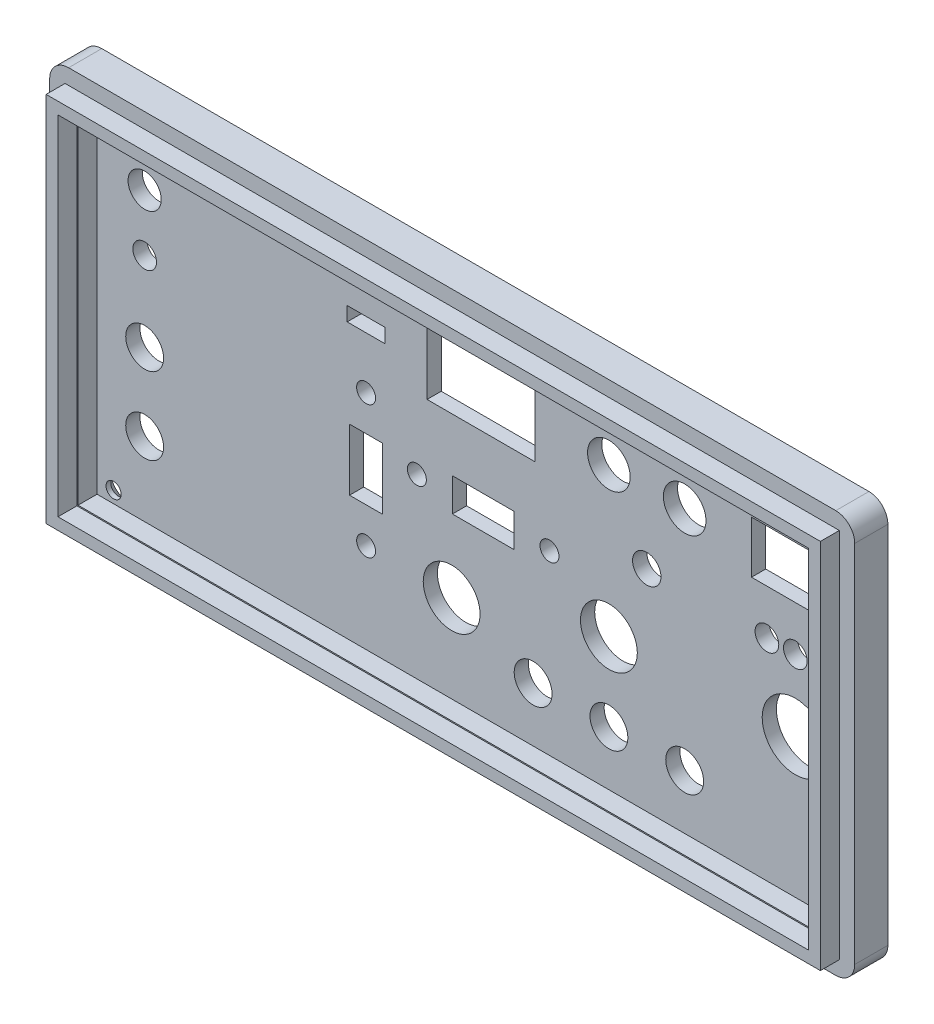
from build123d import *

# Parameters (mm, degrees)
SKETCH_1_W             = 170
SKETCH_1_H             = 85
EXTRUDE_1_DEPTH        = 3
SKETCH_2_W             = 170
SKETCH_2_H             = 85
SKETCH_2_W_2           = 158
SKETCH_2_H_2           = 73
EXTRUDE_1_2_DEPTH      = 4
SKETCH_4_W             = 163.5
SKETCH_4_H             = 78.5
SKETCH_4_W_2           = 158.5
SKETCH_4_H_2           = 73.5
EXTRUDE_2_DEPTH        = 4
FILLET_1_R             = 4
SKETCH_8_R             = 1.6
CUT_EXTRUDE_1_DEPTH    = 10
CHAMFER_1_SIZE         = 2
SKETCH_9_R             = 2.5
SKETCH_9_R_2           = 7
SKETCH_9_W             = 18.5
SKETCH_9_H             = 11
CUT_EXTRUDE_2109_DEPTH = 10
SKETCH_10_R            = 4.5
SKETCH_10_R_2          = 3
CUT_EXTRUDE_2493_DEPTH = 10
SKETCH_12_R            = 2
SKETCH_12_W            = 22.8
SKETCH_12_H            = 14.5
SKETCH_12_W_2          = 13
SKETCH_12_H_2          = 7
CUT_EXTRUDE_2979_DEPTH = 10
CUT_EXTRUDE_3570_DEPTH = 1
SKETCH_15_R            = 4
SKETCH_15_R_2          = 6
MOSFET_TRIAC_DEPTH     = 4
GDS_DEPTH              = 1
SKETCH_17_R            = 6
CUT_EXTRUDE_4097_DEPTH = 5
SKETCH_18_R            = 2
SKETCH_18_W            = 8
SKETCH_18_H            = 3
SKETCH_18_W_2          = 7
SKETCH_18_H_2          = 13
CUT_EXTRUDE_9_DEPTH    = 5
CUT_EXTRUDE_10_DEPTH   = 1
SKETCH_20_R            = 4
SKETCH_20_R_2          = 3.5
SKETCH_20_R_3          = 2.5
CUT_EXTRUDE_11_DEPTH   = 5
CUT_EXTRUDE_12_DEPTH   = 1


with BuildPart() as part:
    # Эскиз1 → Extrude 1 (new body)
    with BuildSketch(Plane.XY):
        Rectangle(SKETCH_1_W, SKETCH_1_H)
    extrude(amount=EXTRUDE_1_DEPTH)

    # Эскиз2 → Extrude 1 2 (add)
    with BuildSketch(Plane.XY.offset(3)):
        Rectangle(SKETCH_2_W, SKETCH_2_H)
        Rectangle(SKETCH_2_W_2, SKETCH_2_H_2, mode=Mode.SUBTRACT)
    extrude(amount=EXTRUDE_1_2_DEPTH)

    # Эскиз4 → Вытянуть-Тонкостенный2 (add)
    with BuildSketch(Plane.XY.offset(7)):
        Rectangle(SKETCH_4_W, SKETCH_4_H)
        Rectangle(SKETCH_4_W_2, SKETCH_4_H_2, mode=Mode.SUBTRACT)
    extrude(amount=EXTRUDE_2_DEPTH)

    # Скругление1
    fillet_1_edges = [part.edges().sort_by_distance(p)[0] for p in [
        (85, -42.5, 3.5),
        (-85, -42.5, 3.5),
        (-85, 42.5, 3.5),
        (85, 42.5, 3.5),
    ]]
    fillet(fillet_1_edges, radius=FILLET_1_R)

    # Эскиз8 → Вырез-Вытянуть1 (cut)
    with BuildSketch(Plane.XY.offset(3)):
        with Locations((-75.5, 34)):
            Circle(SKETCH_8_R)
        with Locations((75.5716933, 35.009625128)):
            Circle(SKETCH_8_R)
        with Locations((75.5716933, -32.990374872)):
            Circle(SKETCH_8_R)
        with Locations((-75.5, -34)):
            Circle(SKETCH_8_R)
    extrude(amount=-CUT_EXTRUDE_1_DEPTH, mode=Mode.SUBTRACT)

    # Фаска1
    chamfer_1_edges = [part.edges().sort_by_distance(p)[0] for p in [
        (-77.1, -34, 0),
        (73.9716933, -32.990374872, 0),
        (73.9716933, 35.009625128, 0),
        (-77.1, 34, 0),
    ]]
    chamfer(chamfer_1_edges, length=CHAMFER_1_SIZE)

    # Эскиз9 → Cut-Extrude 2109 (cut)
    with BuildSketch(Plane(origin=(0, 0, 0), x_dir=(-1, 0, 0), z_dir=(0, 0, -1))):
        with Locations((-74.459611246, 7.927105652)):
            Circle(SKETCH_9_R)
        with Locations((-68.459611246, 7.927105652)):
            Circle(SKETCH_9_R)
        with Locations((-62.459611246, 7.927105652)):
            Circle(SKETCH_9_R)
        with Locations((-68.459611246, -7.072894348)):
            Circle(SKETCH_9_R_2)
        with Locations((-68.459611246, 22.927105652)):
            Rectangle(SKETCH_9_W, SKETCH_9_H)
    extrude(amount=-CUT_EXTRUDE_2109_DEPTH, mode=Mode.SUBTRACT)

    # Эскиз10 → Cut-Extrude 2493 (cut)
    with BuildSketch(Plane(origin=(0, 0, 0), x_dir=(-1, 0, 0), z_dir=(0, 0, -1))):
        with Locations((-45.090705981, 22.927105652)):
            Circle(SKETCH_10_R)
        with Locations((-29.090705981, 22.927105652)):
            Circle(SKETCH_10_R)
        with Locations((-37.090705981, 7.927105652)):
            Circle(SKETCH_10_R_2)
    extrude(amount=-CUT_EXTRUDE_2493_DEPTH, mode=Mode.SUBTRACT)

    # Эскиз12 → Cut-Extrude 2979 (cut)
    with BuildSketch(Plane(origin=(0, 0, 0), x_dir=(-1, 0, 0), z_dir=(0, 0, -1))):
        with Locations((-16.540120913, 0.904075985)):
            Circle(SKETCH_12_R)
        with Locations((11.459879087, 0.904075985)):
            Circle(SKETCH_12_R)
        with Locations((-2.090705981, 22.927105652)):
            Rectangle(SKETCH_12_W, SKETCH_12_H)
        with Locations((-2.540120913, 0.904075985)):
            Rectangle(SKETCH_12_W_2, SKETCH_12_H_2)
    extrude(amount=-CUT_EXTRUDE_2979_DEPTH, mode=Mode.SUBTRACT)

    # Эскиз14 → Cut-Extrude 3570 (cut)
    with BuildSketch(Plane(origin=(0, 0, 0), x_dir=(-1, 0, 0), z_dir=(0, 0, -1))):
        Polygon((-45.66265587, 34.872297673), (-45.66265587, 33.872297673), (-39.66265587, 33.872297673), (-39.66265587, 30.872297673), (-34.946775082, 33.872297673), (-34.946775082, 30.872297673), (-34.044322547, 30.872297673), (-34.044322547, 33.872297673), (-30.299790814, 33.872297673), (-30.299790814, 34.872297673), (-34.044322547, 34.872297673), (-34.044322547, 38.376164807), (-36.164575023, 38.376164807), (-36.164575023, 37.635759181), (-34.946775082, 37.635759181), (-34.946775082, 34.872297673), (-39.66265587, 37.872297673), (-39.66265587, 34.872297673), align=None)
    extrude(amount=-CUT_EXTRUDE_3570_DEPTH, mode=Mode.SUBTRACT)

    # Эскиз15 → Вырез-MOSFET_TRIAC (cut)
    with BuildSketch(Plane(origin=(0, 0, 0), x_dir=(-1, 0, 0), z_dir=(0, 0, -1))):
        with Locations((-45.090705981, -25)):
            Circle(SKETCH_15_R)
        with Locations((-29.090705981, -25)):
            Circle(SKETCH_15_R)
        with Locations((-13.090705981, -25)):
            Circle(SKETCH_15_R)
        with Locations((-29.090705981, -8.479157287)):
            Circle(SKETCH_15_R_2)
    extrude(amount=-MOSFET_TRIAC_DEPTH, mode=Mode.SUBTRACT)

    # Эскиз16 → Вырез-GDS (cut)
    # profile 1 of 3: a face of its own
    with BuildSketch(Plane(origin=(0, 0, 0), x_dir=(-1, 0, 0), z_dir=(0, 0, -1))):
        with BuildLine():
            Line((-45.311984982, -32.547226657), (-43.544356777, -32.547226657))
            Line((-43.544356777, -32.547226657), (-43.892914469, -34.27879717))
            add(Edge.make_bspline(
                [(-43.892914469, -34.27879717), (-43.947735697, -34.311435205), (-44.060886806, -34.378800165), (-44.24554285, -34.466309254), (-44.447941089, -34.545874742), (-44.664809262, -34.618202905), (-44.891751347, -34.678417192), (-45.124072668, -34.720440308), (-45.358370349, -34.747126298), (-45.515440217, -34.750611104), (-45.594036264, -34.752354862)],
                knots=[0, 0, 0, 0, 0.856529829, 1.767879028, 2.740452586, 3.776162205, 4.836818946, 5.890836495, 6.94459762, 8, 8, 8, 8], degree=3))
            add(Edge.make_bspline(
                [(-45.594036264, -34.752354862), (-45.65364461, -34.751656375), (-45.769619976, -34.750297383), (-45.938155818, -34.733325349), (-46.096247788, -34.70902545), (-46.243097656, -34.671317176), (-46.379733064, -34.625617585), (-46.505749481, -34.568374812), (-46.621116181, -34.500747637), (-46.689948226, -34.446524509), (-46.723843956, -34.419822811)],
                knots=[0, 0, 0, 0, 1.189676198, 2.314661307, 3.37902065, 4.380137378, 5.33804995, 6.25210108, 7.139262683, 8, 8, 8, 8], degree=3))
            add(Edge.make_bspline(
                [(-46.723843956, -34.419822811), (-46.76684812, -34.380804243), (-46.85235322, -34.303223694), (-46.961470683, -34.168373624), (-47.054234839, -34.021790678), (-47.129924368, -33.862144519), (-47.189451577, -33.690251912), (-47.230315395, -33.504961624), (-47.256869385, -33.307613824), (-47.259403324, -33.17151582), (-47.260702931, -33.101713837)],
                knots=[0, 0, 0, 0, 0.946224594, 1.881376658, 2.819539382, 3.770728021, 4.757457534, 5.780776585, 6.861804067, 8, 8, 8, 8], degree=3))
            add(Edge.make_bspline(
                [(-47.260702931, -33.101713837), (-47.259793075, -33.053621664), (-47.257981424, -32.957863397), (-47.247704652, -32.814971295), (-47.22911488, -32.673777815), (-47.203157777, -32.534306123), (-47.171626442, -32.396028309), (-47.130876085, -32.259614585), (-47.084322141, -32.124256405), (-47.047008167, -32.036075846), (-47.028331136, -31.991938196)],
                knots=[0, 0, 0, 0, 1.010817455, 2.01267947, 3.009053691, 4.002180965, 4.993466231, 5.988178706, 6.993008603, 8, 8, 8, 8], degree=3))
            add(Edge.make_bspline(
                [(-47.028331136, -31.991938196), (-47.004796601, -31.939739035), (-46.958401439, -31.836835425), (-46.876429993, -31.691140861), (-46.789104139, -31.553158641), (-46.694231527, -31.424217029), (-46.590646384, -31.305171225), (-46.480933608, -31.193963422), (-46.36308422, -31.092456029), (-46.238453695, -30.999819864), (-46.107349247, -30.917216321), (-45.969809016, -30.846191997), (-45.827560754, -30.784256141), (-45.678653282, -30.735964127), (-45.524437554, -30.697425444), (-45.364933131, -30.66915283), (-45.199601865, -30.653143317), (-45.087659812, -30.650920903), (-45.030734982, -30.64979076)],
                knots=[0, 0, 0, 0, 1.072845529, 2.114970322, 3.130254357, 4.132617605, 5.112292059, 6.085870639, 7.058483219, 8.024786783, 8.994392188, 9.959553671, 10.923974677, 11.899263942, 12.890132712, 13.901756093, 14.932999935, 16, 16, 16, 16], degree=3))
            add(Edge.make_bspline(
                [(-45.030734982, -30.64979076), (-44.974339686, -30.650587112), (-44.864270156, -30.652141393), (-44.703412298, -30.667940553), (-44.551019935, -30.692395641), (-44.406972884, -30.72659096), (-44.271711945, -30.771376305), (-44.14533197, -30.827095576), (-44.027091324, -30.891884353), (-43.917583938, -30.966744467), (-43.816814114, -31.051191595), (-43.725402101, -31.145681723), (-43.64160246, -31.248173507), (-43.56757596, -31.360547565), (-43.502711398, -31.481904375), (-43.446734126, -31.612246736), (-43.398859079, -31.751457693), (-43.375306196, -31.84855597), (-43.363267033, -31.898188196)],
                knots=[0, 0, 0, 0, 1.185154985, 2.313126508, 3.394002183, 4.427603278, 5.421875264, 6.384738686, 7.327085139, 8.252128518, 9.168698824, 10.085870807, 11.011850854, 11.947735618, 12.909812975, 13.900654894, 14.926910197, 16, 16, 16, 16], degree=3))
            Line((-43.363267033, -31.898188196), (-44.132497802, -31.983124093))
            add(Edge.make_bspline(
                [(-44.132497802, -31.983124093), (-44.141220219, -31.956286538), (-44.158346897, -31.903590343), (-44.189625268, -31.828300998), (-44.225024757, -31.758149782), (-44.264376552, -31.693040805), (-44.307456299, -31.632729251), (-44.355193999, -31.578005786), (-44.406331052, -31.528003991), (-44.462044395, -31.484057944), (-44.520838949, -31.444447221), (-44.583404091, -31.409679617), (-44.650039735, -31.381523712), (-44.719486747, -31.356316285), (-44.79344158, -31.339893755), (-44.870556375, -31.325602385), (-44.951508379, -31.317657202), (-45.006681036, -31.316861907), (-45.034741392, -31.316457427)],
                knots=[0, 0, 0, 0, 1.114370032, 2.188092794, 3.216703955, 4.215501903, 5.190557844, 6.140400526, 7.080525139, 8.011488033, 8.939096958, 9.878807067, 10.833325926, 11.794295292, 12.792312799, 13.82092396, 14.891739993, 16, 16, 16, 16], degree=3))
            add(Edge.make_bspline(
                [(-45.034741392, -31.316457427), (-45.067884431, -31.317064688), (-45.133776269, -31.318271987), (-45.231753554, -31.328239335), (-45.32761433, -31.344066478), (-45.421482628, -31.366448849), (-45.512667899, -31.396738716), (-45.602871624, -31.431346707), (-45.689891924, -31.474504373), (-45.775410366, -31.522104441), (-45.8568461, -31.577710453), (-45.935025983, -31.638995196), (-46.007349691, -31.708813586), (-46.075617019, -31.785158566), (-46.139832183, -31.868583928), (-46.199159419, -31.959462868), (-46.253511708, -32.057322081), (-46.302797623, -32.161357109), (-46.347515463, -32.269562826), (-46.38611797, -32.381120888), (-46.417852693, -32.495570545), (-46.445351464, -32.611983395), (-46.466331841, -32.731292704), (-46.480309935, -32.852787961), (-46.489538486, -32.976839731), (-46.490822591, -33.060297598), (-46.491472161, -33.102515119)],
                knots=[0, 0, 0, 0, 0.922668929, 1.834362646, 2.739113967, 3.626583317, 4.5179393, 5.412856076, 6.314238875, 7.220089902, 8.135929835, 9.056978834, 9.98275964, 10.930796125, 11.906604397, 12.911151493, 13.949886437, 15.021022448, 16.114844578, 17.208489716, 18.30564406, 19.420501231, 20.538034182, 21.676358401, 22.824575915, 24, 24, 24, 24], degree=3))
            add(Edge.make_bspline(
                [(-46.491472161, -33.102515119), (-46.491066674, -33.143147243), (-46.490283323, -33.221643238), (-46.478367529, -33.335085696), (-46.46136047, -33.440485764), (-46.436569925, -33.537881639), (-46.40466546, -33.62739073), (-46.365382704, -33.708489842), (-46.319568885, -33.781910513), (-46.26542342, -33.846115136), (-46.204750628, -33.902694892), (-46.137617827, -33.952061887), (-46.063673428, -33.993837298), (-45.982806854, -34.027309127), (-45.895940831, -34.054014933), (-45.802428808, -34.071927321), (-45.702495747, -34.083435474), (-45.633600054, -34.084921336), (-45.598042674, -34.085688196)],
                knots=[0, 0, 0, 0, 1.279485184, 2.471799493, 3.589568795, 4.640638414, 5.633472236, 6.578100822, 7.474538588, 8.352621136, 9.215902565, 10.08266292, 10.971923517, 11.884604191, 12.834875301, 13.829988718, 14.880047337, 16, 16, 16, 16], degree=3))
            add(Edge.make_bspline(
                [(-45.598042674, -34.085688196), (-45.553927022, -34.084817557), (-45.464902611, -34.083060627), (-45.330805373, -34.066844837), (-45.195083932, -34.042139575), (-45.059616164, -34.007616279), (-44.928049295, -33.966831073), (-44.804264858, -33.920624166), (-44.689163576, -33.872709309), (-44.617573287, -33.835380664), (-44.582818315, -33.817258709)],
                knots=[0, 0, 0, 0, 0.998692142, 2.015338636, 3.054621171, 4.121146324, 5.179112479, 6.172367922, 7.112738573, 8, 8, 8, 8], degree=3))
            Line((-44.582818315, -33.817258709), (-44.461824726, -33.213893324))
            Line((-44.461824726, -33.213893324), (-45.465831136, -33.213893324))
            Line((-45.465831136, -33.213893324), (-45.311984982, -32.547226657))
        make_face()
    # profile 2 of 3: a face of its own
    with BuildSketch(Plane(origin=(0, 0, 0), x_dir=(-1, 0, 0), z_dir=(0, 0, -1))):
        with BuildLine():
            Line((-31.085295986, -34.701072811), (-30.271994704, -30.701072811))
            Line((-30.271994704, -30.701072811), (-29.20789214, -30.701072811))
            add(Edge.make_bspline(
                [(-29.20789214, -30.701072811), (-29.172635345, -30.700986807), (-29.105325806, -30.700822615), (-29.009441636, -30.701928398), (-28.923430439, -30.702441363), (-28.847299095, -30.703976534), (-28.781065932, -30.706472465), (-28.724983628, -30.708953769), (-28.6789844, -30.710892329), (-28.651795415, -30.713529492), (-28.639783166, -30.714694606)],
                knots=[0, 0, 0, 0, 1.48857211, 2.841866469, 4.048564738, 5.12012296, 6.056730267, 6.846849188, 7.490531369, 8, 8, 8, 8], degree=3))
            add(Edge.make_bspline(
                [(-28.639783166, -30.714694606), (-28.599891692, -30.719152712), (-28.521822586, -30.727877392), (-28.409075497, -30.751032534), (-28.302433143, -30.778412495), (-28.202708406, -30.814179238), (-28.107842611, -30.855901757), (-28.017796231, -30.905877097), (-27.932083247, -30.963607148), (-27.850931358, -31.028791316), (-27.774548009, -31.10090774), (-27.703982482, -31.180891308), (-27.637974128, -31.267237905), (-27.578677701, -31.361621937), (-27.52533953, -31.462777592), (-27.476227205, -31.570291821), (-27.437234959, -31.686436495), (-27.402305831, -31.808713946), (-27.37544404, -31.93808917), (-27.355087333, -32.073386621), (-27.344197402, -32.214781492), (-27.342546594, -32.310831818), (-27.341706243, -32.359726657)],
                knots=[0, 0, 0, 0, 1.032402116, 2.020449548, 2.959065353, 3.863409455, 4.743422901, 5.623302132, 6.509734044, 7.399596752, 8.29904334, 9.209452827, 10.141477343, 11.092989849, 12.07383917, 13.082962336, 14.130671572, 15.223015926, 16.354010083, 17.528224417, 18.741731799, 20, 20, 20, 20], degree=3))
            add(Edge.make_bspline(
                [(-27.341706243, -32.359726657), (-27.342526733, -32.412896988), (-27.344144816, -32.517753705), (-27.355453349, -32.672911207), (-27.374588571, -32.823218665), (-27.401336119, -32.969196861), (-27.434381467, -33.110686225), (-27.476420489, -33.247636386), (-27.52604479, -33.379785341), (-27.583004505, -33.506908195), (-27.645442899, -33.628395284), (-27.712188681, -33.744079125), (-27.782246435, -33.853827667), (-27.857049969, -33.956723506), (-27.935690306, -34.05279611), (-28.017502655, -34.143234759), (-28.103932066, -34.226523123), (-28.164857042, -34.27753651), (-28.195071627, -34.302835632)],
                knots=[0, 0, 0, 0, 1.163204969, 2.293945731, 3.401421659, 4.476513256, 5.539515548, 6.578328026, 7.608310343, 8.625835259, 9.624151876, 10.59537111, 11.546842134, 12.471375482, 13.376707625, 14.261901809, 15.138023201, 16, 16, 16, 16], degree=3))
            add(Edge.make_bspline(
                [(-28.195071627, -34.302835632), (-28.219149637, -34.321573414), (-28.268021492, -34.359606051), (-28.34636627, -34.411481443), (-28.43029888, -34.45858381), (-28.518730318, -34.502889547), (-28.612300356, -34.543667829), (-28.711042332, -34.580407397), (-28.814721902, -34.613618453), (-28.886204785, -34.631740721), (-28.92263573, -34.640976657)],
                knots=[0, 0, 0, 0, 0.905151725, 1.83721345, 2.784915334, 3.759673714, 4.77127606, 5.812108657, 6.884950553, 8, 8, 8, 8], degree=3))
            add(Edge.make_bspline(
                [(-28.92263573, -34.640976657), (-28.945020994, -34.646048096), (-28.992210279, -34.65673895), (-29.068038324, -34.668105283), (-29.152148577, -34.678808857), (-29.244949121, -34.686306314), (-29.346188548, -34.692801607), (-29.455991043, -34.697411494), (-29.57432309, -34.700880237), (-29.656073041, -34.701007244), (-29.698276755, -34.701072811)],
                knots=[0, 0, 0, 0, 0.706492935, 1.489323379, 2.35942964, 3.316944278, 4.355246541, 5.483005566, 6.700592326, 8, 8, 8, 8], degree=3))
            Line((-29.698276755, -34.701072811), (-31.085295986, -34.701072811))
        make_face()
        with BuildLine():
            Line((-30.166225473, -34.034406145), (-29.741545986, -34.034406145))
            add(Edge.make_bspline(
                [(-29.741545986, -34.034406145), (-29.704420067, -34.034234179), (-29.633097748, -34.033903817), (-29.529949423, -34.031902859), (-29.434900491, -34.026531702), (-29.347449292, -34.021649681), (-29.268111257, -34.013440833), (-29.19647872, -34.003919578), (-29.132777367, -33.99304261), (-29.058573015, -33.976046094), (-28.972870638, -33.947330746), (-28.875408052, -33.90116561), (-28.781629678, -33.843651261), (-28.724713345, -33.796353475), (-28.695872909, -33.772386914)],
                knots=[0, 0, 0, 0, 1.208627196, 2.321884474, 3.357896066, 4.307596301, 5.172775071, 5.95362668, 6.659792425, 7.275661467, 8.43048497, 9.593462955, 10.780568347, 12, 12, 12, 12], degree=3))
            add(Edge.make_bspline(
                [(-28.695872909, -33.772386914), (-28.655410189, -33.73373543), (-28.572860347, -33.654880776), (-28.463956912, -33.516915389), (-28.365653707, -33.36085741), (-28.291420523, -33.219124085), (-28.239353292, -33.096456216), (-28.205410703, -32.998886982), (-28.17508941, -32.897803508), (-28.152337943, -32.792122701), (-28.134022395, -32.682747473), (-28.120214258, -32.569150114), (-28.112130953, -32.45172717), (-28.11133826, -32.372025481), (-28.110937012, -32.331681786)],
                knots=[0, 0, 0, 0, 1.256284537, 2.563003359, 3.936683933, 5.397085044, 6.152911021, 6.92933369, 7.717545432, 8.522871357, 9.356682034, 10.209122878, 11.093487194, 12, 12, 12, 12], degree=3))
            add(Edge.make_bspline(
                [(-28.110937012, -32.331681786), (-28.111463758, -32.297754416), (-28.112489182, -32.231707491), (-28.118511782, -32.135887079), (-28.130101135, -32.04663946), (-28.144291174, -31.963824817), (-28.1661398, -31.888230539), (-28.189216906, -31.818313522), (-28.218245943, -31.755150337), (-28.262765956, -31.681816921), (-28.325332253, -31.601469737), (-28.409339033, -31.520218415), (-28.503334312, -31.457170493), (-28.571894465, -31.430123393), (-28.606129319, -31.416617683)],
                knots=[0, 0, 0, 0, 1.093120344, 2.127993991, 3.090699036, 3.991951438, 4.831177654, 5.623057314, 6.362273219, 7.064715453, 8.383167751, 9.630870476, 10.816997908, 12, 12, 12, 12], degree=3))
            add(Edge.make_bspline(
                [(-28.606129319, -31.416617683), (-28.619447644, -31.412747279), (-28.648262557, -31.404373452), (-28.695530518, -31.393843437), (-28.750282053, -31.386621711), (-28.811892827, -31.378795818), (-28.880951202, -31.374809897), (-28.957044414, -31.370441647), (-29.040411267, -31.368181642), (-29.098382751, -31.367890868), (-29.128565217, -31.367739478)],
                knots=[0, 0, 0, 0, 0.632261075, 1.367930885, 2.204865338, 3.148869127, 4.198627512, 5.357033493, 6.623957175, 8, 8, 8, 8], degree=3))
            Line((-29.128565217, -31.367739478), (-29.623757525, -31.367739478))
            Line((-29.623757525, -31.367739478), (-30.166225473, -34.034406145))
        make_face(mode=Mode.SUBTRACT)
    # profile 3 of 3: a face of its own
    with BuildSketch(Plane(origin=(0, 0, 0), x_dir=(-1, 0, 0), z_dir=(0, 0, -1))):
        with BuildLine():
            Line((-15.294058372, -33.505559991), (-14.524827603, -33.47030358))
            add(Edge.make_bspline(
                [(-14.524827603, -33.47030358), (-14.523218264, -33.495964292), (-14.520126154, -33.545267611), (-14.511553098, -33.615695103), (-14.499081995, -33.679480727), (-14.485708857, -33.737258991), (-14.466611716, -33.788145428), (-14.446254428, -33.832868193), (-14.423273129, -33.871973193), (-14.403690668, -33.892882198), (-14.394218628, -33.902995888)],
                knots=[0, 0, 0, 0, 1.338401869, 2.571544142, 3.689646782, 4.72160185, 5.654154903, 6.512654842, 7.280570887, 8, 8, 8, 8], degree=3))
            add(Edge.make_bspline(
                [(-14.394218628, -33.902995888), (-14.377482391, -33.917611633), (-14.342919583, -33.947795308), (-14.28182509, -33.985727262), (-14.210602389, -34.016465636), (-14.130023725, -34.041996048), (-14.039883986, -34.061671917), (-13.94003274, -34.076151741), (-13.830493924, -34.083535396), (-13.75427052, -34.0849529), (-13.714731449, -34.085688196)],
                knots=[0, 0, 0, 0, 0.740006547, 1.528223015, 2.385411705, 3.32043692, 4.342388029, 5.458232194, 6.681518637, 8, 8, 8, 8], degree=3))
            add(Edge.make_bspline(
                [(-13.714731449, -34.085688196), (-13.681602427, -34.085183434), (-13.617683665, -34.084209553), (-13.525358645, -34.078009657), (-13.43994912, -34.066928072), (-13.361760668, -34.051075898), (-13.290379658, -34.031080791), (-13.226182085, -34.006763175), (-13.16948792, -33.976617853), (-13.119538332, -33.942991059), (-13.076079934, -33.905807905), (-13.03856965, -33.866823385), (-13.006423184, -33.825860073), (-12.980211963, -33.783158608), (-12.959771784, -33.738213313), (-12.945151343, -33.691704875), (-12.937311361, -33.643107584), (-12.935831682, -33.610285659), (-12.935084013, -33.593701016)],
                knots=[0, 0, 0, 0, 1.541748103, 2.97463141, 4.303633857, 5.54686395, 6.683971274, 7.75040306, 8.73455875, 9.665385113, 10.547113836, 11.391060761, 12.179252193, 12.96587391, 13.716824054, 14.471673132, 15.227749275, 16, 16, 16, 16], degree=3))
            add(Edge.make_bspline(
                [(-12.935084013, -33.593701016), (-12.936868068, -33.565129573), (-12.940398148, -33.50859574), (-12.970956117, -33.427769041), (-13.021106025, -33.354713928), (-13.06631105, -33.315262377), (-13.089731449, -33.294822811)],
                knots=[0, 0, 0, 0, 0.980987747, 1.94106394, 2.933279992, 4, 4, 4, 4], degree=3))
            add(Edge.make_bspline(
                [(-13.089731449, -33.294822811), (-13.10055649, -33.286625978), (-13.125633785, -33.267637192), (-13.171391373, -33.240580272), (-13.228326275, -33.20937261), (-13.296911351, -33.174675445), (-13.377969781, -33.137546535), (-13.470524489, -33.095843214), (-13.575136744, -33.051094466), (-13.687858504, -33.00356549), (-13.802951974, -32.956439723), (-13.912781279, -32.909242647), (-14.014136595, -32.863184416), (-14.108151944, -32.821329675), (-14.193307213, -32.78028981), (-14.270093836, -32.740991921), (-14.338910794, -32.704405445), (-14.418920185, -32.658924264), (-14.508810828, -32.599220288), (-14.603102296, -32.515483339), (-14.686524819, -32.422904256), (-14.757509713, -32.320093052), (-14.813830262, -32.207075255), (-14.855224552, -32.084865442), (-14.879433526, -31.953096458), (-14.882321611, -31.862231136), (-14.883801962, -31.815656145)],
                knots=[0, 0, 0, 0, 0.393468919, 0.91151026, 1.538895855, 2.276657064, 3.139441536, 4.12399002, 5.220271156, 6.438612364, 7.671246028, 8.826510552, 9.904639992, 10.899431523, 11.810471427, 12.645234875, 13.400592035, 14.070157394, 15.313909074, 16.521171526, 17.716851339, 18.919883095, 20.132153413, 21.366537702, 22.650161778, 24, 24, 24, 24], degree=3))
            add(Edge.make_bspline(
                [(-14.883801962, -31.815656145), (-14.882836324, -31.774720528), (-14.880933563, -31.694058147), (-14.862545404, -31.575970109), (-14.834059746, -31.462680753), (-14.79257244, -31.355306664), (-14.741520934, -31.252217948), (-14.676608935, -31.155985669), (-14.600581693, -31.065046544), (-14.51438229, -30.979131945), (-14.416583861, -30.901308303), (-14.307630002, -30.833669308), (-14.188265084, -30.777166899), (-14.059303015, -30.729161494), (-13.919487769, -30.693814726), (-13.769416751, -30.668549941), (-13.609334748, -30.651923973), (-13.498962767, -30.650514442), (-13.442295551, -30.64979076)],
                knots=[0, 0, 0, 0, 0.940257979, 1.852749596, 2.740177573, 3.620377655, 4.493441094, 5.378828223, 6.281185805, 7.214503923, 8.171350068, 9.147459841, 10.155181588, 11.20208401, 12.30542441, 13.464064348, 14.697999167, 16, 16, 16, 16], degree=3))
            add(Edge.make_bspline(
                [(-13.442295551, -30.64979076), (-13.384564132, -30.650860659), (-13.272341786, -30.652940404), (-13.108988678, -30.66922869), (-12.955473835, -30.69542244), (-12.811517575, -30.73179513), (-12.677908139, -30.779981652), (-12.554480138, -30.838804062), (-12.440524123, -30.907531721), (-12.338272352, -30.988261379), (-12.245511197, -31.076641705), (-12.16360594, -31.172633791), (-12.093736786, -31.276226221), (-12.033447892, -31.385830444), (-11.985997434, -31.503364291), (-11.947683457, -31.627278782), (-11.922192763, -31.758722101), (-11.913750453, -31.848947791), (-11.909442987, -31.894983068)],
                knots=[0, 0, 0, 0, 1.254371771, 2.438335023, 3.563367815, 4.636083037, 5.660591219, 6.64454082, 7.603152874, 8.545942733, 9.469617992, 10.383742694, 11.282049191, 12.180711895, 13.096898093, 14.031451158, 14.995599911, 16, 16, 16, 16], degree=3))
            Line((-11.909442987, -31.894983068), (-12.678673757, -31.931842042))
            add(Edge.make_bspline(
                [(-12.678673757, -31.931842042), (-12.681766165, -31.907742889), (-12.687820516, -31.860561297), (-12.703148871, -31.792193609), (-12.723329833, -31.728308078), (-12.746697855, -31.667989313), (-12.778013077, -31.613713081), (-12.812334337, -31.562662062), (-12.851709141, -31.516080254), (-12.896068905, -31.473799972), (-12.946350192, -31.437275808), (-13.000971138, -31.40353301), (-13.062451228, -31.376879329), (-13.128833852, -31.354211607), (-13.201181363, -31.337854164), (-13.278427407, -31.324783752), (-13.361771293, -31.317774197), (-13.419046698, -31.316906664), (-13.448705808, -31.316457427)],
                knots=[0, 0, 0, 0, 1.054969143, 2.065430432, 3.037811344, 3.964187601, 4.867912082, 5.752824153, 6.633696379, 7.51181396, 8.40745996, 9.328663942, 10.29458701, 11.310826016, 12.371711098, 13.512260734, 14.711765875, 16, 16, 16, 16], degree=3))
            add(Edge.make_bspline(
                [(-13.448705808, -31.316457427), (-13.477560251, -31.316687951), (-13.533192555, -31.317132409), (-13.613474915, -31.322669932), (-13.687255466, -31.332403721), (-13.754886072, -31.344726947), (-13.815891089, -31.361710914), (-13.870853375, -31.381422911), (-13.91948035, -31.405354152), (-13.973466294, -31.4422224), (-14.030096454, -31.49340933), (-14.078711792, -31.566150399), (-14.109496919, -31.646904761), (-14.112857364, -31.704003638), (-14.114571193, -31.733124093)],
                knots=[0, 0, 0, 0, 1.177035476, 2.269362719, 3.280342504, 4.212114027, 5.071289313, 5.860748402, 6.591715113, 7.274733439, 8.523809903, 9.678284861, 10.815924174, 12, 12, 12, 12], degree=3))
            add(Edge.make_bspline(
                [(-14.114571193, -31.733124093), (-14.112919074, -31.760324601), (-14.109682986, -31.813603599), (-14.082670974, -31.889531785), (-14.038441345, -31.95799006), (-13.997735214, -31.994665929), (-13.97675068, -32.013572811)],
                knots=[0, 0, 0, 0, 1.00744669, 1.973336279, 2.955228786, 4, 4, 4, 4], degree=3))
            add(Edge.make_bspline(
                [(-13.97675068, -32.013572811), (-13.963536048, -32.023654875), (-13.934467217, -32.045832853), (-13.883516052, -32.077418198), (-13.822328394, -32.111689589), (-13.751128867, -32.149384247), (-13.669268389, -32.189260315), (-13.577078403, -32.231690393), (-13.474306642, -32.276388577), (-13.402258146, -32.306905148), (-13.364571193, -32.322867683)],
                knots=[0, 0, 0, 0, 0.579988031, 1.275826245, 2.090042166, 3.0285208, 4.087730242, 5.268433077, 6.571178552, 8, 8, 8, 8], degree=3))
            add(Edge.make_bspline(
                [(-13.364571193, -32.322867683), (-13.307576792, -32.346393231), (-13.198741261, -32.391317215), (-13.044585375, -32.459465095), (-12.906954349, -32.524557689), (-12.784567495, -32.584489175), (-12.679987605, -32.643568966), (-12.59006359, -32.696623154), (-12.516727436, -32.747347114), (-12.475441317, -32.782766855), (-12.456718628, -32.798829221)],
                knots=[0, 0, 0, 0, 1.438220226, 2.746400682, 3.930877721, 4.989646501, 5.923969973, 6.731737498, 7.424860366, 8, 8, 8, 8], degree=3))
            add(Edge.make_bspline(
                [(-12.456718628, -32.798829221), (-12.433516305, -32.821601823), (-12.387642345, -32.866626171), (-12.328185396, -32.941615477), (-12.278176615, -33.021555648), (-12.237135884, -33.106190802), (-12.204871619, -33.195295086), (-12.18255675, -33.289396155), (-12.168648564, -33.388157393), (-12.166797126, -33.455833589), (-12.165853244, -33.490335632)],
                knots=[0, 0, 0, 0, 1.008703419, 1.994335688, 2.963076186, 3.931141987, 4.909630885, 5.899267329, 6.929024219, 8, 8, 8, 8], degree=3))
            add(Edge.make_bspline(
                [(-12.165853244, -33.490335632), (-12.167069906, -33.533138448), (-12.169470262, -33.617584246), (-12.189001397, -33.741886615), (-12.222331922, -33.860933018), (-12.267287193, -33.975955202), (-12.326060711, -34.085822912), (-12.398278784, -34.190973591), (-12.483439075, -34.290770875), (-12.580262658, -34.385581013), (-12.688868691, -34.471681064), (-12.808226722, -34.547995701), (-12.938607859, -34.610508467), (-13.078314247, -34.66348414), (-13.228588596, -34.702813119), (-13.388792521, -34.731486254), (-13.559136032, -34.749578248), (-13.676223335, -34.751412623), (-13.736366064, -34.752354862)],
                knots=[0, 0, 0, 0, 0.910210877, 1.795757608, 2.668322607, 3.535599565, 4.417603145, 5.312740096, 6.243935742, 7.204213704, 8.190937306, 9.187103454, 10.21115374, 11.261181147, 12.360986678, 13.510001348, 14.720994414, 16, 16, 16, 16], degree=3))
            add(Edge.make_bspline(
                [(-13.736366064, -34.752354862), (-13.778308071, -34.751888971), (-13.860653419, -34.75097428), (-13.982352934, -34.743882287), (-14.099356755, -34.730751146), (-14.212608021, -34.714336542), (-14.32114881, -34.691819922), (-14.425739971, -34.664586881), (-14.526039827, -34.632462528), (-14.621809951, -34.596146906), (-14.711686258, -34.55442657), (-14.794907649, -34.508489948), (-14.872590658, -34.460470137), (-14.941330986, -34.405573451), (-15.005323766, -34.349605984), (-15.060482349, -34.287840653), (-15.110235624, -34.223460871), (-15.152400334, -34.154442593), (-15.188423918, -34.082144135), (-15.218734675, -34.00725721), (-15.244794145, -33.930331925), (-15.264272057, -33.850293717), (-15.281078715, -33.768131177), (-15.289943388, -33.682826342), (-15.295139618, -33.595103151), (-15.294422911, -33.535749231), (-15.294058372, -33.505559991)],
                knots=[0, 0, 0, 0, 1.32504508, 2.601480127, 3.849226944, 5.043796448, 6.215466271, 7.349334281, 8.456802685, 9.541239285, 10.583216378, 11.583957158, 12.543730137, 13.46365281, 14.359935022, 15.226119146, 16.07503265, 16.927461685, 17.776542925, 18.624281346, 19.478170914, 20.339780634, 21.225152394, 22.125318924, 23.046479196, 24, 24, 24, 24], degree=3))
        make_face()
    extrude(amount=-GDS_DEPTH, mode=Mode.SUBTRACT)

    # Эскиз17 → Cut-Extrude 4097 (cut)
    with BuildSketch(Plane(origin=(0, 0, 0), x_dir=(-1, 0, 0), z_dir=(0, 0, -1))):
        with Locations((4.117945211, -18)):
            Circle(SKETCH_17_R)
    extrude(amount=-CUT_EXTRUDE_4097_DEPTH, mode=Mode.SUBTRACT)

    # Эскиз18 → Вырез-Вытянуть9 (cut)
    with BuildSketch(Plane(origin=(0, 0, 0), x_dir=(-1, 0, 0), z_dir=(0, 0, -1))):
        with Locations((22.180846952, 10.478615876)):
            Circle(SKETCH_18_R)
        with Locations((22.180846952, -17.521384124)):
            Circle(SKETCH_18_R)
        with Locations((22.180846952, 22.927105652)):
            Rectangle(SKETCH_18_W, SKETCH_18_H)
        with Locations((22.180846952, -3.521384124)):
            Rectangle(SKETCH_18_W_2, SKETCH_18_H_2)
    extrude(amount=-CUT_EXTRUDE_9_DEPTH, mode=Mode.SUBTRACT)

    # Эскиз19 → Вырез-Вытянуть10 (cut)
    # profile 1 of 14: a face of its own
    with BuildSketch(Plane(origin=(0, 0, 0), x_dir=(-1, 0, 0), z_dir=(0, 0, -1))):
        Polygon((16.778986417, 26.720476244), (16.191246032, 26.720476244), (16.699659494, 29.220476244), (15.86612584, 29.220476244), (15.981510455, 29.720476244), (18.327664301, 29.720476244), (18.212279686, 29.220476244), (17.287399878, 29.220476244), align=None)
    # profile 2 of 14: a face of its own
    with BuildSketch(Plane(origin=(0, 0, 0), x_dir=(-1, 0, 0), z_dir=(0, 0, -1))):
        Polygon((18.096895071, 26.720476244), (18.706871032, 29.720476244), (19.294611417, 29.720476244), (18.786197955, 27.220476244), (20.36612584, 27.220476244), (20.250741224, 26.720476244), align=None)
    # profile 3 of 14: a face of its own
    with BuildSketch(Plane(origin=(0, 0, 0), x_dir=(-1, 0, 0), z_dir=(0, 0, -1))):
        Polygon((21.684034494, 27.33586086), (20.519971994, 27.33586086), (20.622736417, 27.827447398), (22.199058532, 29.682014706), (22.749539301, 29.682014706), (22.373337378, 27.83586086), (22.789202763, 27.83586086), (22.675020071, 27.33586086), (22.271173917, 27.33586086), (22.145572955, 26.720476244), (21.558433532, 26.720476244), align=None)
        Polygon((21.786197955, 27.83586086), (21.974298917, 28.758937783), (21.212279686, 27.83586086), align=None, mode=Mode.SUBTRACT)
    # profile 4 of 14: a face of its own
    with BuildSketch(Plane(origin=(0, 0, 0), x_dir=(-1, 0, 0), z_dir=(0, 0, -1))):
        with BuildLine():
            Line((22.943048917, 27.499322398), (23.519971994, 27.566630091))
            add(Edge.make_bspline(
                [(23.519971994, 27.566630091), (23.523008818, 27.547371661), (23.528854794, 27.510298612), (23.540000536, 27.457198115), (23.554200162, 27.409055043), (23.568822329, 27.365093486), (23.585590663, 27.325824589), (23.604357861, 27.291260491), (23.624557928, 27.26096313), (23.654265265, 27.227436297), (23.696824242, 27.193002912), (23.75599445, 27.164048036), (23.822907826, 27.146829697), (23.869825514, 27.144678559), (23.894371032, 27.143553168)],
                knots=[0, 0, 0, 0, 1.113628087, 2.143767114, 3.096244365, 3.979169228, 4.789001066, 5.531439386, 6.223306081, 6.863777167, 8.084317951, 9.32269645, 10.599338429, 12, 12, 12, 12], degree=3))
            add(Edge.make_bspline(
                [(23.894371032, 27.143553168), (23.911012292, 27.144104474), (23.943600709, 27.145184092), (23.991580728, 27.151038096), (24.03726876, 27.161912353), (24.080626216, 27.177101564), (24.122145907, 27.195720779), (24.161157223, 27.219277935), (24.198031613, 27.247264079), (24.232585293, 27.278709114), (24.263969199, 27.31376303), (24.29149367, 27.351315563), (24.314816985, 27.391569907), (24.332979659, 27.434351847), (24.348636655, 27.478935835), (24.35825063, 27.526261067), (24.365503926, 27.57562111), (24.365915836, 27.609469417), (24.36612584, 27.626726244)],
                knots=[0, 0, 0, 0, 1.056188299, 2.068323169, 3.061037812, 4.029784429, 4.979669581, 5.943148733, 6.914227274, 7.912864265, 8.902971643, 9.894464984, 10.86246086, 11.847168951, 12.839964961, 13.854650497, 14.906239987, 16, 16, 16, 16], degree=3))
            add(Edge.make_bspline(
                [(24.36612584, 27.626726244), (24.365000647, 27.656095676), (24.36283536, 27.712613288), (24.342336353, 27.792543819), (24.307213947, 27.862637354), (24.258591287, 27.921888382), (24.19872717, 27.969966623), (24.128252393, 28.004004389), (24.04861798, 28.025017718), (23.992265297, 28.027088671), (23.962880648, 28.028168552)],
                knots=[0, 0, 0, 0, 1.095421233, 2.107994187, 3.054892396, 4.001376713, 4.948984032, 5.899245802, 6.904578767, 8, 8, 8, 8], degree=3))
            add(Edge.make_bspline(
                [(23.962880648, 28.028168552), (23.947023763, 28.027935195), (23.914572364, 28.027457624), (23.882517553, 28.022361216), (23.86612584, 28.019755091)],
                knots=[0, 0, 0, 0, 0.977269667, 2, 2, 2, 2], degree=3))
            Line((23.86612584, 28.019755091), (23.971294109, 28.493913744))
            add(Edge.make_bspline(
                [(23.971294109, 28.493913744), (23.981500123, 28.4927632), (24.001473252, 28.490511588), (24.021565095, 28.489971247), (24.031390263, 28.489707014)],
                knots=[0, 0, 0, 0, 1.02197443, 2, 2, 2, 2], degree=3))
            add(Edge.make_bspline(
                [(24.031390263, 28.489707014), (24.050846906, 28.489934854), (24.088458517, 28.490375293), (24.142956663, 28.497125812), (24.194157311, 28.505099271), (24.241269852, 28.519773331), (24.285511812, 28.536050587), (24.325829763, 28.557156193), (24.362312782, 28.582229514), (24.395564119, 28.610432333), (24.424857612, 28.64224167), (24.45037457, 28.676941649), (24.472258325, 28.714283263), (24.489400618, 28.754825587), (24.503505852, 28.797570689), (24.512844131, 28.843154825), (24.519164366, 28.891171215), (24.519699071, 28.924180578), (24.519971994, 28.941029129)],
                knots=[0, 0, 0, 0, 1.234581455, 2.386567803, 3.484608767, 4.519130617, 5.513774472, 6.475410053, 7.399892117, 8.320251121, 9.238497591, 10.139216456, 11.051273423, 11.980034509, 12.929475557, 13.905062537, 14.930707578, 16, 16, 16, 16], degree=3))
            add(Edge.make_bspline(
                [(24.519971994, 28.941029129), (24.519217453, 28.964365141), (24.517775112, 29.008973014), (24.50221458, 29.072042388), (24.477832105, 29.127715619), (24.442972943, 29.174801722), (24.399948285, 29.212231927), (24.35042393, 29.240132603), (24.293954885, 29.255996584), (24.254446148, 29.257931993), (24.233914301, 29.258937783)],
                knots=[0, 0, 0, 0, 1.160092262, 2.217570391, 3.213382614, 4.16920723, 5.109651143, 6.034135627, 6.978382317, 8, 8, 8, 8], degree=3))
            add(Edge.make_bspline(
                [(24.233914301, 29.258937783), (24.214131771, 29.257834145), (24.17491636, 29.255646377), (24.118080362, 29.23622328), (24.064627432, 29.205748104), (24.023850994, 29.170745716), (23.993578952, 29.136429629), (23.971581712, 29.106074474), (23.951263866, 29.07119403), (23.9310021, 29.03282248), (23.913602479, 28.989210135), (23.89590505, 28.942129606), (23.880446093, 28.89039788), (23.871024982, 28.854518674), (23.86612584, 28.83586086)],
                knots=[0, 0, 0, 0, 1.169918999, 2.319159976, 3.521189638, 4.801626595, 5.483142924, 6.231442765, 7.019673485, 7.874848059, 8.801197839, 9.8006416, 10.856295195, 12, 12, 12, 12], degree=3))
            Line((23.86612584, 28.83586086), (23.289202763, 28.94523586))
            add(Edge.make_bspline(
                [(23.289202763, 28.94523586), (23.298011676, 28.972149217), (23.315223131, 29.024734366), (23.343951836, 29.100764437), (23.375724238, 29.171882987), (23.410764531, 29.23782082), (23.44729153, 29.299459881), (23.486415535, 29.356257926), (23.528369972, 29.408172357), (23.558986479, 29.439452495), (23.574058532, 29.454851244)],
                knots=[0, 0, 0, 0, 1.152223226, 2.251292216, 3.305715338, 4.319367465, 5.288140949, 6.219712528, 7.123590791, 8, 8, 8, 8], degree=3))
            add(Edge.make_bspline(
                [(23.574058532, 29.454851244), (23.597240086, 29.476238281), (23.643036884, 29.518489883), (23.719100562, 29.57169155), (23.798163812, 29.617836919), (23.881308482, 29.65606761), (23.968897985, 29.684796315), (24.060303871, 29.705069853), (24.155410679, 29.718183698), (24.220248976, 29.719704604), (24.253145071, 29.720476244)],
                knots=[0, 0, 0, 0, 1.010741123, 1.996790489, 2.970004596, 3.944829705, 4.926324837, 5.920942814, 6.945177992, 8, 8, 8, 8], degree=3))
            add(Edge.make_bspline(
                [(24.253145071, 29.720476244), (24.286633943, 29.719844603), (24.351792176, 29.718615637), (24.446195622, 29.70738233), (24.534745864, 29.690599287), (24.616655336, 29.66488161), (24.693138787, 29.633579481), (24.762465092, 29.593217613), (24.826314849, 29.547102253), (24.882469389, 29.493072311), (24.932730638, 29.43497014), (24.977071276, 29.373666417), (25.013446953, 29.308803643), (25.044932395, 29.241863479), (25.067793035, 29.171476123), (25.085186493, 29.09859582), (25.094520972, 29.022801613), (25.096097316, 28.97129984), (25.096895071, 28.94523586)],
                knots=[0, 0, 0, 0, 1.244726817, 2.421825338, 3.530573555, 4.590796444, 5.608975142, 6.596616442, 7.566486485, 8.530705274, 9.48648612, 10.420779404, 11.338203718, 12.248098079, 13.166731121, 14.084578671, 15.030644948, 16, 16, 16, 16], degree=3))
            add(Edge.make_bspline(
                [(25.096895071, 28.94523586), (25.096326138, 28.926194428), (25.095197536, 28.888421582), (25.08944204, 28.832461273), (25.078340426, 28.778062998), (25.06333666, 28.724998097), (25.043989708, 28.673175214), (25.020636915, 28.622655759), (24.992679732, 28.573753682), (24.950433955, 28.510588987), (24.888100095, 28.437867577), (24.800114191, 28.362163267), (24.699154585, 28.29900136), (24.624656802, 28.268485028), (24.586678724, 28.252928168)],
                knots=[0, 0, 0, 0, 0.747375294, 1.482582425, 2.204004923, 2.923068493, 3.644319692, 4.372264089, 5.104439773, 5.852186967, 7.351827465, 8.84550302, 10.391875237, 12, 12, 12, 12], degree=3))
            add(Edge.make_bspline(
                [(24.586678724, 28.252928168), (24.615619587, 28.235837853), (24.672045204, 28.202517092), (24.746478612, 28.141331771), (24.809026946, 28.07269364), (24.857902858, 27.996587693), (24.895728183, 27.916568941), (24.922995469, 27.83425251), (24.939961127, 27.750017714), (24.942017995, 27.693109685), (24.943048917, 27.664586821)],
                knots=[0, 0, 0, 0, 1.113896387, 2.171749032, 3.183558438, 4.182780009, 5.160955452, 6.113108675, 7.054271511, 8, 8, 8, 8], degree=3))
            add(Edge.make_bspline(
                [(24.943048917, 27.664586821), (24.942429569, 27.637497622), (24.941194463, 27.583476181), (24.928956365, 27.503528929), (24.911366364, 27.424895873), (24.885155217, 27.348047954), (24.85122383, 27.273104793), (24.810925552, 27.199253585), (24.762697594, 27.127539879), (24.725677321, 27.082366577), (24.706871032, 27.059418552)],
                knots=[0, 0, 0, 0, 0.978707876, 1.951744996, 2.918020136, 3.889114633, 4.881130906, 5.88919755, 6.927712903, 8, 8, 8, 8], degree=3))
            add(Edge.make_bspline(
                [(24.706871032, 27.059418552), (24.679647881, 27.029351589), (24.625992929, 26.970091677), (24.535741605, 26.892971535), (24.439833736, 26.827599457), (24.337926297, 26.774337271), (24.230361494, 26.732510527), (24.116605071, 26.70318067), (23.997091609, 26.685474924), (23.915465597, 26.683181491), (23.87393834, 26.682014706)],
                knots=[0, 0, 0, 0, 1.028825916, 2.027744919, 3.005204614, 3.969653394, 4.940476267, 5.928462148, 6.946104497, 8, 8, 8, 8], degree=3))
            add(Edge.make_bspline(
                [(23.87393834, 26.682014706), (23.842868967, 26.682803864), (23.781783684, 26.684355423), (23.692240996, 26.693681246), (23.606876295, 26.710807682), (23.52570215, 26.733933225), (23.448760352, 26.764391551), (23.375889629, 26.800795078), (23.307519333, 26.844684805), (23.243301661, 26.89427532), (23.184112063, 26.950289859), (23.131226369, 27.01252557), (23.083967251, 27.079954397), (23.043910132, 27.153424642), (23.008601876, 27.231555973), (22.980816696, 27.315913116), (22.957392825, 27.405325921), (22.94789595, 27.467559505), (22.943048917, 27.499322398)],
                knots=[0, 0, 0, 0, 1.088933873, 2.140945501, 3.150110956, 4.136581762, 5.094744864, 6.046016751, 6.986634536, 7.937284542, 8.88572877, 9.836767499, 10.794904883, 11.765866709, 12.765192876, 13.79526275, 14.874742078, 16, 16, 16, 16], degree=3))
        make_face()
    # profile 5 of 14: a face of its own
    with BuildSketch(Plane(origin=(0, 0, 0), x_dir=(-1, 0, 0), z_dir=(0, 0, -1))):
        with BuildLine():
            Line((25.558433532, 28.412783937), (25.673818148, 28.951245475))
            add(Edge.make_bspline(
                [(25.673818148, 28.951245475), (25.732575965, 28.978756801), (25.847668088, 29.032644728), (26.012617076, 29.121013043), (26.167606647, 29.21191383), (26.312393655, 29.306591836), (26.447049545, 29.40415125), (26.571241558, 29.505670902), (26.686178092, 29.609508338), (26.755255248, 29.683911366), (26.789202763, 29.720476244)],
                knots=[0, 0, 0, 0, 1.141248788, 2.235425872, 3.290749984, 4.301473644, 5.277793596, 6.214608812, 7.122581234, 8, 8, 8, 8], degree=3))
            Line((26.789202763, 29.720476244), (27.185236417, 29.720476244))
            Line((27.185236417, 29.720476244), (26.56925084, 26.720476244))
            Line((26.56925084, 26.720476244), (25.981510455, 26.720476244))
            Line((25.981510455, 26.720476244), (26.403986417, 28.778769514))
            add(Edge.make_bspline(
                [(26.403986417, 28.778769514), (26.372743475, 28.758596452), (26.30886653, 28.717352143), (26.206899309, 28.660654631), (26.098329878, 28.605891735), (25.984716001, 28.55554237), (25.871507336, 28.508979095), (25.76178232, 28.470257816), (25.6586925, 28.436823542), (25.590997723, 28.420592019), (25.558433532, 28.412783937)],
                knots=[0, 0, 0, 0, 0.963986056, 1.970892671, 3.02307353, 4.115725476, 5.192060844, 6.195787894, 7.132093922, 8, 8, 8, 8], degree=3))
        make_face()
    # profile 6 of 14: a face of its own
    with BuildSketch(Plane(origin=(0, 0, 0), x_dir=(-1, 0, 0), z_dir=(0, 0, -1))):
        with BuildLine():
            Line((16.622474057, 17.258421142), (16.034733672, 17.258421142))
            Line((16.034733672, 17.258421142), (16.644709634, 20.258421142))
            Line((16.644709634, 20.258421142), (17.965623096, 20.258421142))
            add(Edge.make_bspline(
                [(17.965623096, 20.258421142), (17.993267067, 20.25811843), (18.046968978, 20.257530372), (18.125193428, 20.255058959), (18.19844669, 20.24837614), (18.2673552, 20.241926809), (18.331237739, 20.231422433), (18.390669564, 20.219572583), (18.445338093, 20.205345855), (18.495635519, 20.188248979), (18.542861973, 20.169228017), (18.586609742, 20.145196525), (18.629110025, 20.119065427), (18.668690002, 20.088342132), (18.70552439, 20.053598374), (18.740637629, 20.015574152), (18.773407614, 19.973790346), (18.803539591, 19.928578284), (18.830551429, 19.88032053), (18.854642278, 19.829657774), (18.874370885, 19.776020117), (18.891466354, 19.720373281), (18.903830552, 19.661804443), (18.912873238, 19.600799546), (18.918329523, 19.537366996), (18.919006426, 19.494208927), (18.919349057, 19.47236345)],
                knots=[0, 0, 0, 0, 1.397997146, 2.71578631, 3.955711479, 5.116837282, 6.214271876, 7.22740948, 8.180699214, 9.067986365, 9.91261871, 10.750971626, 11.588467393, 12.433342657, 13.279006929, 14.146412957, 15.048152737, 15.961200041, 16.890950814, 17.84251689, 18.794514173, 19.778313476, 20.783622796, 21.817908339, 22.895482704, 24, 24, 24, 24], degree=3))
            add(Edge.make_bspline(
                [(18.919349057, 19.47236345), (18.918641812, 19.441084936), (18.917259678, 19.379958884), (18.906860898, 19.290277035), (18.889700766, 19.204927934), (18.864836012, 19.123644649), (18.832878435, 19.04665865), (18.794399405, 18.973392141), (18.748369475, 18.904761787), (18.695941497, 18.840142717), (18.63658336, 18.78010796), (18.568452633, 18.727560704), (18.494187667, 18.679466754), (18.411906248, 18.63804173), (18.321997664, 18.602945958), (18.225127579, 18.572661292), (18.120703997, 18.549461668), (18.048430878, 18.538627353), (18.011296172, 18.533060565)],
                knots=[0, 0, 0, 0, 1.034210287, 2.021106028, 2.981224027, 3.909550721, 4.827322501, 5.734126229, 6.641776499, 7.55535462, 8.482853643, 9.42644268, 10.394866648, 11.405142831, 12.466783848, 13.583603239, 14.758429358, 16, 16, 16, 16], degree=3))
            add(Edge.make_bspline(
                [(18.011296172, 18.533060565), (18.031147819, 18.514427155), (18.072060773, 18.476024906), (18.12705572, 18.408798834), (18.182637805, 18.335169906), (18.215494944, 18.28097722), (18.232450019, 18.253012488)],
                knots=[0, 0, 0, 0, 0.911289116, 1.878107672, 2.905052469, 4, 4, 4, 4], degree=3))
            add(Edge.make_bspline(
                [(18.232450019, 18.253012488), (18.249844068, 18.222253907), (18.28607357, 18.158187855), (18.339209579, 18.05640515), (18.394918465, 17.945992875), (18.450085232, 17.825638578), (18.508177698, 17.69680151), (18.567319606, 17.558895871), (18.628354729, 17.411980439), (18.668124915, 17.310576174), (18.688579826, 17.258421142)],
                knots=[0, 0, 0, 0, 0.774320282, 1.612806617, 2.515893427, 3.484157077, 4.513797032, 5.613040525, 6.772320409, 8, 8, 8, 8], degree=3))
            Line((18.688579826, 17.258421142), (18.073195211, 17.258421142))
            add(Edge.make_bspline(
                [(18.073195211, 17.258421142), (18.065531665, 17.280911068), (18.049155338, 17.328970072), (18.019645756, 17.404789647), (17.986295679, 17.489846275), (17.947838294, 17.583697341), (17.903649377, 17.685847006), (17.854973503, 17.79702682), (17.801585709, 17.917357418), (17.763590804, 18.000249188), (17.743868288, 18.043276911)],
                knots=[0, 0, 0, 0, 0.669633086, 1.430947364, 2.292823778, 3.244897855, 4.289531818, 5.429840925, 6.665873656, 8, 8, 8, 8], degree=3))
            add(Edge.make_bspline(
                [(17.743868288, 18.043276911), (17.732877458, 18.06642894), (17.711620694, 18.111206011), (17.677154326, 18.174164817), (17.643023807, 18.231875934), (17.607775384, 18.283172044), (17.572132819, 18.329021584), (17.535545086, 18.368380388), (17.499049957, 18.402822667), (17.47285368, 18.421354744), (17.460214442, 18.430296142)],
                knots=[0, 0, 0, 0, 1.266796771, 2.450042299, 3.547265759, 4.580161745, 5.525235817, 6.415311767, 7.235416088, 8, 8, 8, 8], degree=3))
            add(Edge.make_bspline(
                [(17.460214442, 18.430296142), (17.451902246, 18.435104699), (17.434403123, 18.445227841), (17.404438064, 18.457070682), (17.370388555, 18.466957187), (17.332113175, 18.475691468), (17.289415619, 18.481026403), (17.242383419, 18.486326342), (17.190995323, 18.488174474), (17.155325633, 18.488844308), (17.136897134, 18.489190373)],
                knots=[0, 0, 0, 0, 0.692669078, 1.458231005, 2.318635533, 3.252171975, 4.289336311, 5.423539077, 6.668889229, 8, 8, 8, 8], degree=3))
            Line((17.136897134, 18.489190373), (16.872474057, 18.489190373))
            Line((16.872474057, 18.489190373), (16.622474057, 17.258421142))
        make_face()
        with BuildLine():
            Line((16.966224057, 18.950728834), (17.303964442, 18.950728834))
            add(Edge.make_bspline(
                [(17.303964442, 18.950728834), (17.344829831, 18.951065063), (17.423161929, 18.951709555), (17.535184317, 18.953646621), (17.636564228, 18.958604722), (17.726965016, 18.964938869), (17.80675121, 18.973288871), (17.875598275, 18.98314319), (17.933862135, 18.994965503), (17.996407817, 19.012792915), (18.063023843, 19.042644391), (18.135106143, 19.083844036), (18.196269319, 19.136275091), (18.24869845, 19.194640947), (18.289785524, 19.258888264), (18.320586331, 19.325198901), (18.338790918, 19.39388023), (18.3412152, 19.440210107), (18.34242598, 19.463349027)],
                knots=[0, 0, 0, 0, 1.50888834, 2.892285894, 4.136248101, 5.256027101, 6.237795427, 7.097596577, 7.822872553, 8.431428343, 9.494855671, 10.509612591, 11.485961217, 12.455196353, 13.396863832, 14.290544765, 15.146232392, 16, 16, 16, 16], degree=3))
            add(Edge.make_bspline(
                [(18.34242598, 19.463349027), (18.341866066, 19.476584343), (18.340774351, 19.502390452), (18.335147307, 19.5399251), (18.323806581, 19.574700641), (18.309157097, 19.607425228), (18.288941277, 19.63684994), (18.264929621, 19.663885891), (18.236856919, 19.688654617), (18.215232154, 19.702223158), (18.204204826, 19.709142296)],
                knots=[0, 0, 0, 0, 1.072207581, 2.090581457, 3.059874968, 4.024818191, 4.982787312, 5.936216595, 6.947594817, 8, 8, 8, 8], degree=3))
            add(Edge.make_bspline(
                [(18.204204826, 19.709142296), (18.196276981, 19.713147012), (18.178724921, 19.722013357), (18.147921108, 19.731754279), (18.111068272, 19.739824486), (18.068219087, 19.747403187), (18.018928707, 19.751327727), (17.963694771, 19.756008552), (17.902138588, 19.758216478), (17.859053337, 19.758350649), (17.836416365, 19.758421142)],
                knots=[0, 0, 0, 0, 0.56921737, 1.260233634, 2.064715267, 2.990294769, 4.049329649, 5.235318658, 6.547437606, 8, 8, 8, 8], degree=3))
            Line((17.836416365, 19.758421142), (17.130887519, 19.758421142))
            Line((17.130887519, 19.758421142), (16.966224057, 18.950728834))
        make_face(mode=Mode.SUBTRACT)
    # profile 7 of 14: a face of its own
    with BuildSketch(Plane(origin=(0, 0, 0), x_dir=(-1, 0, 0), z_dir=(0, 0, -1))):
        Polygon((22.126680788, 17.912267296), (20.954805788, 17.912267296), (20.611656749, 17.258421142), (19.965623096, 17.258421142), (21.582209634, 20.258421142), (22.31117598, 20.258421142), (22.809974057, 17.258421142), (22.227041365, 17.258421142), align=None)
        Polygon((22.049757711, 18.412267296), (21.861656749, 19.643036527), (21.216224057, 18.412267296), align=None, mode=Mode.SUBTRACT)
    # profile 8 of 14: a face of its own
    with BuildSketch(Plane(origin=(0, 0, 0), x_dir=(-1, 0, 0), z_dir=(0, 0, -1))):
        with BuildLine():
            Line((26.496272134, 18.335344219), (27.073195211, 18.241594219))
            add(Edge.make_bspline(
                [(27.073195211, 18.241594219), (27.057496633, 18.201108056), (27.026698926, 18.121681688), (26.972248654, 18.008216635), (26.912062209, 17.902293171), (26.846574256, 17.803194105), (26.774823547, 17.711749643), (26.697734701, 17.627104001), (26.614728906, 17.550087392), (26.526187483, 17.480859587), (26.432840695, 17.419511373), (26.335454415, 17.365898156), (26.234150122, 17.320638455), (26.128945743, 17.283958908), (26.019910258, 17.254906214), (25.906741659, 17.234682347), (25.789611831, 17.222434373), (25.710244238, 17.220792943), (25.669950019, 17.219959604)],
                knots=[0, 0, 0, 0, 1.120190723, 2.197607124, 3.24397274, 4.261874307, 5.259733453, 6.240291705, 7.213245009, 8.178007374, 9.137144902, 10.092598043, 11.043622314, 11.996723429, 12.964679395, 13.952243081, 14.96037206, 16, 16, 16, 16], degree=3))
            add(Edge.make_bspline(
                [(25.669950019, 17.219959604), (25.625238104, 17.221056657), (25.537959033, 17.223198141), (25.410570768, 17.238179561), (25.2907698, 17.263767926), (25.178479771, 17.300201902), (25.073616831, 17.346129038), (24.976580709, 17.403270279), (24.887110507, 17.470413954), (24.805182219, 17.547352601), (24.732014433, 17.634387613), (24.668810452, 17.731181615), (24.615076532, 17.837182064), (24.571159718, 17.952387297), (24.538014187, 18.076977769), (24.513183614, 18.210317427), (24.498899963, 18.353060689), (24.497164493, 18.451298012), (24.496272134, 18.501810565)],
                knots=[0, 0, 0, 0, 1.085315143, 2.118569465, 3.10862569, 4.054399014, 4.979697534, 5.882107621, 6.781748788, 7.689957848, 8.60461449, 9.535264547, 10.490009234, 11.484355565, 12.522473361, 13.615517901, 14.773925484, 16, 16, 16, 16], degree=3))
            add(Edge.make_bspline(
                [(24.496272134, 18.501810565), (24.496719678, 18.543702629), (24.497605449, 18.626614549), (24.508609971, 18.749528238), (24.524311027, 18.869790632), (24.547603454, 18.987241375), (24.575889732, 19.102290459), (24.612559454, 19.214179707), (24.654305725, 19.323757811), (24.703008342, 19.429878394), (24.757201046, 19.531560522), (24.817167789, 19.627486358), (24.881125245, 19.717938762), (24.951012596, 19.801592323), (25.026094976, 19.878716335), (25.10522618, 19.95071613), (25.190411223, 20.015501942), (25.27974982, 20.074374014), (25.372897868, 20.126452432), (25.468352309, 20.172252911), (25.565941535, 20.210858363), (25.665615355, 20.242122289), (25.767151754, 20.266905612), (25.870982604, 20.284321965), (25.976829468, 20.294673165), (26.048132486, 20.296143035), (26.084012519, 20.296882681)],
                knots=[0, 0, 0, 0, 1.12523935, 2.227050856, 3.313292014, 4.382599094, 5.442600102, 6.494521581, 7.54407194, 8.591771311, 9.629622085, 10.637752118, 11.629469383, 12.603918084, 13.563130138, 14.519695875, 15.475655712, 16.435547068, 17.392249081, 18.340785765, 19.278309278, 20.209461071, 21.145469232, 22.084305101, 23.036012832, 24, 24, 24, 24], degree=3))
            add(Edge.make_bspline(
                [(26.084012519, 20.296882681), (26.123701024, 20.296001986), (26.201241878, 20.294281342), (26.314822977, 20.282970827), (26.422544054, 20.26317896), (26.524498054, 20.235547268), (26.62072629, 20.200300015), (26.71046175, 20.155809988), (26.795354867, 20.10499345), (26.873190529, 20.045139347), (26.944928659, 19.979247144), (27.008778263, 19.906795417), (27.064951293, 19.828913755), (27.113434541, 19.745441594), (27.153584072, 19.655871428), (27.186820728, 19.560889586), (27.211509026, 19.459778442), (27.221791716, 19.39013185), (27.227041365, 19.354574988)],
                knots=[0, 0, 0, 0, 1.161704084, 2.269662874, 3.336921827, 4.363910212, 5.358327418, 6.331213957, 7.29156266, 8.24968916, 9.199888487, 10.138712567, 11.071179636, 12.006481463, 12.959065868, 13.940029214, 14.948317568, 16, 16, 16, 16], degree=3))
            Line((27.227041365, 19.354574988), (26.650118288, 19.296882681))
            add(Edge.make_bspline(
                [(26.650118288, 19.296882681), (26.645872696, 19.318205822), (26.637626768, 19.359620327), (26.619616531, 19.418591488), (26.600224556, 19.473444669), (26.577367569, 19.523557512), (26.551380652, 19.569003693), (26.522447056, 19.610090251), (26.490665392, 19.646985206), (26.455452694, 19.679124735), (26.41729841, 19.70667784), (26.37665728, 19.731201564), (26.332630336, 19.751409379), (26.285852448, 19.768392264), (26.235819267, 19.780749937), (26.183299103, 19.790565982), (26.127391173, 19.795882899), (26.089231087, 19.796542944), (26.069589442, 19.796882681)],
                knots=[0, 0, 0, 0, 1.229230562, 2.387452017, 3.48445341, 4.518971464, 5.498718437, 6.441999951, 7.357785896, 8.248186656, 9.132218023, 10.016539903, 10.929164929, 11.868352912, 12.827633112, 13.841269931, 14.888864931, 16, 16, 16, 16], degree=3))
            add(Edge.make_bspline(
                [(26.069589442, 19.796882681), (26.047738224, 19.796408735), (26.004316774, 19.795466938), (25.939731731, 19.788266453), (25.876612762, 19.775245939), (25.814142089, 19.758675439), (25.75299756, 19.736165527), (25.6925265, 19.709255997), (25.633886052, 19.676379335), (25.575817202, 19.639937489), (25.519966792, 19.597920815), (25.466942455, 19.55021967), (25.416755771, 19.496903631), (25.369600363, 19.43805925), (25.324739965, 19.373994597), (25.283266548, 19.304038609), (25.245245557, 19.228238719), (25.197288967, 19.121590339), (25.148091961, 18.983953209), (25.105135208, 18.816399145), (25.077998448, 18.648931333), (25.074788721, 18.536964985), (25.073195211, 18.481377873)],
                knots=[0, 0, 0, 0, 0.715634228, 1.42206611, 2.124617896, 2.82492966, 3.536824664, 4.256298352, 4.990430999, 5.736689279, 6.500394913, 7.276291084, 8.06995943, 8.89584237, 9.744019556, 10.629564897, 11.556785668, 12.520074357, 14.458457809, 16.334615648, 18.180273474, 20, 20, 20, 20], degree=3))
            add(Edge.make_bspline(
                [(25.073195211, 18.481377873), (25.073803731, 18.451912607), (25.074990232, 18.394460847), (25.083273454, 18.310828786), (25.097724281, 18.232475714), (25.117438226, 18.159161748), (25.14313994, 18.090971318), (25.175340475, 18.028113467), (25.212552251, 17.970147861), (25.255221935, 17.917636425), (25.302834592, 17.87182558), (25.352955826, 17.830875254), (25.406401485, 17.796583926), (25.462897704, 17.769118666), (25.521279402, 17.746023202), (25.583300307, 17.731763987), (25.647764994, 17.721365454), (25.691940303, 17.720433749), (25.714421172, 17.719959604)],
                knots=[0, 0, 0, 0, 1.262413303, 2.461469894, 3.596099647, 4.672558692, 5.710271384, 6.712118391, 7.692973228, 8.656781597, 9.603625613, 10.519141984, 11.426251528, 12.316764329, 13.207814667, 14.109180762, 15.037759764, 16, 16, 16, 16], degree=3))
            add(Edge.make_bspline(
                [(25.714421172, 17.719959604), (25.735275553, 17.720420407), (25.776908127, 17.72134033), (25.838599837, 17.728780672), (25.899202703, 17.740610832), (25.957932835, 17.758314431), (26.015575266, 17.780158199), (26.072181649, 17.806268972), (26.126688166, 17.838745991), (26.180574179, 17.874352137), (26.231300537, 17.916010627), (26.279677949, 17.961836998), (26.324915293, 18.012186323), (26.365774455, 18.068088805), (26.403526102, 18.128240965), (26.438580404, 18.19271668), (26.469995063, 18.261989269), (26.487398004, 18.310571238), (26.496272134, 18.335344219)],
                knots=[0, 0, 0, 0, 0.9385555, 1.873682197, 2.79333162, 3.714968522, 4.631118387, 5.56707088, 6.51673801, 7.484683101, 8.471968626, 9.467048524, 10.482554268, 11.514227771, 12.580058633, 13.677615787, 14.8157668, 16, 16, 16, 16], degree=3))
        make_face()
    # profile 9 of 14: a face of its own
    with BuildSketch(Plane(origin=(0, 0, 0), x_dir=(-1, 0, 0), z_dir=(0, 0, -1))):
        with BuildLine():
            Line((28.590225926, 4.421582503), (27.820995156, 4.539370965))
            add(Edge.make_bspline(
                [(27.820995156, 4.539370965), (27.829423315, 4.585187598), (27.845860516, 4.674542494), (27.880969423, 4.803458143), (27.921986948, 4.924604273), (27.971683519, 5.03734662), (28.029816578, 5.141121009), (28.094735288, 5.237261301), (28.168069161, 5.324727414), (28.248233989, 5.404506468), (28.335497883, 5.474765038), (28.428265367, 5.535778477), (28.525568687, 5.588920634), (28.629517366, 5.629926378), (28.738047345, 5.662895214), (28.851589037, 5.687354711), (28.970778547, 5.700723399), (29.051999964, 5.702650679), (29.093431054, 5.703633785)],
                knots=[0, 0, 0, 0, 1.176560694, 2.294613297, 3.37234743, 4.405619833, 5.402576082, 6.374013457, 7.332234665, 8.281838666, 9.227212998, 10.157436275, 11.084349095, 12.022955127, 12.97507356, 13.947892898, 14.95321905, 16, 16, 16, 16], degree=3))
            add(Edge.make_bspline(
                [(29.093431054, 5.703633785), (29.138598281, 5.702663919), (29.226475409, 5.700776954), (29.35473854, 5.687487177), (29.475205017, 5.66304558), (29.588722083, 5.630810472), (29.694233462, 5.587770109), (29.793061077, 5.536648125), (29.88364429, 5.474630943), (29.966195551, 5.403805149), (30.040450337, 5.326647418), (30.105241222, 5.243414393), (30.159777874, 5.154906015), (30.205106013, 5.061644317), (30.239664349, 4.962892272), (30.26422504, 4.859239178), (30.280161367, 4.750333051), (30.28173197, 4.67591315), (30.282533618, 4.637928657)],
                knots=[0, 0, 0, 0, 1.205999613, 2.34638671, 3.437311622, 4.484516006, 5.49231974, 6.474825341, 7.450004718, 8.416145608, 9.374490329, 10.304583212, 11.226850936, 12.14547179, 13.067987639, 14.014154949, 14.986409304, 16, 16, 16, 16], degree=3))
            add(Edge.make_bspline(
                [(30.282533618, 4.637928657), (30.281518927, 4.598331639), (30.279486315, 4.519011544), (30.260826472, 4.400144365), (30.231234636, 4.281283632), (30.188853352, 4.161770902), (30.134164991, 4.040428538), (30.063232707, 3.917875797), (29.979201683, 3.7911458), (29.91355953, 3.709270972), (29.879488746, 3.666774811)],
                knots=[0, 0, 0, 0, 0.88481403, 1.772444921, 2.683471917, 3.620264019, 4.603781152, 5.654851415, 6.782778345, 8, 8, 8, 8], degree=3))
            add(Edge.make_bspline(
                [(29.879488746, 3.666774811), (29.865593871, 3.650755973), (29.836075591, 3.616725545), (29.789354421, 3.562568112), (29.734015355, 3.505863336), (29.675536315, 3.441554027), (29.608149531, 3.37507256), (29.536785348, 3.301678005), (29.457512996, 3.224964821), (29.375275793, 3.144535406), (29.292748582, 3.066029106), (29.216946733, 2.991172616), (29.147737465, 2.923904191), (29.085984627, 2.863057458), (29.031824767, 2.808510215), (28.984224259, 2.761550343), (28.944902987, 2.720467612), (28.883011685, 2.654016389), (28.798360504, 2.556153041), (28.728219814, 2.466744801), (28.692790028, 2.421582503)],
                knots=[0, 0, 0, 0, 0.665174907, 1.413097954, 2.24279202, 3.149643092, 4.138963606, 5.211218311, 6.360529316, 7.598766324, 8.819333918, 9.933103059, 10.940247435, 11.84663401, 12.652293758, 13.351322069, 13.943837409, 14.435847888, 16.199659217, 18, 18, 18, 18], degree=3))
            Line((28.692790028, 2.421582503), (29.97484131, 2.421582503))
            Line((29.97484131, 2.421582503), (29.820995156, 1.703633785))
            Line((29.820995156, 1.703633785), (27.462020798, 1.703633785))
            add(Edge.make_bspline(
                [(27.462020798, 1.703633785), (27.469400078, 1.752158271), (27.484089384, 1.848751836), (27.522140652, 1.990266793), (27.569762424, 2.128565007), (27.630376495, 2.262493347), (27.701356876, 2.391964863), (27.779436498, 2.517856143), (27.866664711, 2.638467562), (27.946857328, 2.736684143), (28.019052289, 2.818527956), (28.084653145, 2.888146753), (28.159352697, 2.967544143), (28.245844967, 3.054428606), (28.340541541, 3.152034017), (28.447600538, 3.256251448), (28.563632388, 3.370461819), (28.644909833, 3.448897971), (28.687181054, 3.489691477)],
                knots=[0, 0, 0, 0, 1.063730775, 2.117478306, 3.172689597, 4.233134709, 5.301052612, 6.373125639, 7.443804969, 8.526715156, 9.121778271, 9.810345173, 10.601138625, 11.485912787, 12.468987183, 13.550362503, 14.725979039, 16, 16, 16, 16], degree=3))
            add(Edge.make_bspline(
                [(28.687181054, 3.489691477), (28.718767634, 3.520336559), (28.77895632, 3.578731207), (28.863685883, 3.663080587), (28.939771358, 3.738437367), (29.007333072, 3.804687522), (29.065145865, 3.863338645), (29.11368458, 3.913876704), (29.154210119, 3.95513368), (29.177109454, 3.980804685), (29.187181054, 3.992095323)],
                knots=[0, 0, 0, 0, 1.489933264, 2.839089461, 4.047578686, 5.115401406, 6.042558295, 6.835521558, 7.487838325, 8, 8, 8, 8], degree=3))
            add(Edge.make_bspline(
                [(29.187181054, 3.992095323), (29.216004559, 4.026072882), (29.270467878, 4.09027502), (29.343756344, 4.184218445), (29.399979228, 4.272970698), (29.443546564, 4.354549843), (29.474575622, 4.431341698), (29.495996398, 4.503571701), (29.511137268, 4.571863808), (29.512600065, 4.616488996), (29.513302849, 4.637928657)],
                knots=[0, 0, 0, 0, 1.447764524, 2.735616712, 3.867084987, 4.856905771, 5.736767602, 6.552173182, 7.304408147, 8, 8, 8, 8], degree=3))
            add(Edge.make_bspline(
                [(29.513302849, 4.637928657), (29.51203896, 4.669851365), (29.509596077, 4.731552549), (29.487469467, 4.819001867), (29.451878167, 4.897615408), (29.401153722, 4.964405433), (29.340200072, 5.01961232), (29.26982325, 5.059896771), (29.190834201, 5.083848149), (29.135531513, 5.08675319), (29.107052849, 5.08824917)],
                knots=[0, 0, 0, 0, 1.125749503, 2.175882966, 3.163483604, 4.153963288, 5.115958572, 6.049648829, 6.995647438, 8, 8, 8, 8], degree=3))
            add(Edge.make_bspline(
                [(29.107052849, 5.08824917), (29.077988623, 5.086648706), (29.020138956, 5.083463132), (28.936899651, 5.054717133), (28.859975323, 5.008172624), (28.801122881, 4.956124134), (28.759434244, 4.90325589), (28.728594808, 4.856216076), (28.700045381, 4.801706074), (28.673657354, 4.739774106), (28.649993142, 4.670511273), (28.62726508, 4.594182763), (28.607749494, 4.510297522), (28.59619447, 4.451798924), (28.590225926, 4.421582503)],
                knots=[0, 0, 0, 0, 1.131594318, 2.252334341, 3.392871184, 4.625570627, 5.29301933, 6.01580277, 6.817825761, 7.691063802, 8.640488087, 9.672865114, 10.797959421, 12, 12, 12, 12], degree=3))
        make_face()
    # profile 10 of 14: a face of its own
    with BuildSketch(Plane(origin=(0, 0, 0), x_dir=(-1, 0, 0), z_dir=(0, 0, -1))):
        Polygon((30.641507977, 2.472864554), (31.410738746, 2.472864554), (31.256892592, 1.703633785), (30.487661823, 1.703633785), align=None)
    # profile 11 of 14: a face of its own
    with BuildSketch(Plane(origin=(0, 0, 0), x_dir=(-1, 0, 0), z_dir=(0, 0, -1))):
        with BuildLine():
            Line((32.128687464, 2.863088913), (32.897918233, 2.934403016))
            add(Edge.make_bspline(
                [(32.897918233, 2.934403016), (32.89733592, 2.917844498), (32.896331075, 2.889270983), (32.895756143, 2.860685757), (32.895514387, 2.848665836)],
                knots=[0, 0, 0, 0, 1.159011638, 2, 2, 2, 2], degree=3))
            add(Edge.make_bspline(
                [(32.895514387, 2.848665836), (32.896602745, 2.803142258), (32.898647794, 2.71760248), (32.921280172, 2.598209003), (32.957057112, 2.495805442), (33.009905721, 2.412286627), (33.075180053, 2.347819371), (33.149597513, 2.300714657), (33.233799865, 2.272178052), (33.29299555, 2.269243541), (33.323399003, 2.267736349)],
                knots=[0, 0, 0, 0, 1.341925504, 2.521506763, 3.571437794, 4.524846347, 5.411108981, 6.257529879, 7.105051216, 8, 8, 8, 8], degree=3))
            add(Edge.make_bspline(
                [(33.323399003, 2.267736349), (33.345346991, 2.268535001), (33.389303048, 2.270134491), (33.454389826, 2.282220691), (33.517663787, 2.30373061), (33.579179441, 2.332539231), (33.639416634, 2.369250783), (33.698053304, 2.414297812), (33.754425251, 2.468436359), (33.810049562, 2.528955453), (33.860901776, 2.597190071), (33.905140013, 2.672539864), (33.943307326, 2.753905485), (33.972897681, 2.842040201), (33.99766265, 2.935876211), (34.013713252, 3.036261836), (34.024639996, 3.142760924), (34.02562123, 3.215890393), (34.026123362, 3.253313272)],
                knots=[0, 0, 0, 0, 0.785245061, 1.572639651, 2.358524376, 3.170988934, 3.998826408, 4.878251758, 5.811359837, 6.792529224, 7.817197541, 8.849947874, 9.914756081, 11.027150937, 12.17240601, 13.383950538, 14.661276998, 16, 16, 16, 16], degree=3))
            add(Edge.make_bspline(
                [(34.026123362, 3.253313272), (34.024608648, 3.296465576), (34.021755115, 3.377759195), (33.996006972, 3.491710736), (33.953178273, 3.589550278), (33.890551834, 3.668991569), (33.813900344, 3.730483505), (33.725745507, 3.775641201), (33.625314225, 3.801490075), (33.55485331, 3.804584342), (33.518110541, 3.806197888)],
                knots=[0, 0, 0, 0, 1.213846073, 2.286736321, 3.26968816, 4.196590222, 5.105835978, 6.017474284, 6.966185952, 8, 8, 8, 8], degree=3))
            add(Edge.make_bspline(
                [(33.518110541, 3.806197888), (33.490798781, 3.805288653), (33.436064304, 3.80346649), (33.354990277, 3.788163987), (33.274640848, 3.765159355), (33.19608392, 3.730976381), (33.118754843, 3.687469501), (33.043260029, 3.633799075), (32.968116502, 3.571454491), (32.921769492, 3.523291424), (32.897918233, 3.49850558)],
                knots=[0, 0, 0, 0, 0.918827584, 1.841388023, 2.769062061, 3.727857164, 4.718346892, 5.751201275, 6.842715423, 8, 8, 8, 8], degree=3))
            Line((32.897918233, 3.49850558), (32.333815669, 3.551390195))
            Line((32.333815669, 3.551390195), (32.897918233, 5.652351734))
            Line((32.897918233, 5.652351734), (35.000482336, 5.652351734))
            Line((35.000482336, 5.652351734), (34.846636182, 4.934403016))
            Line((34.846636182, 4.934403016), (33.499681054, 4.934403016))
            Line((33.499681054, 4.934403016), (33.326604131, 4.292576093))
            add(Edge.make_bspline(
                [(33.326604131, 4.292576093), (33.363528379, 4.312565655), (33.435199829, 4.351366198), (33.548093973, 4.391267816), (33.66011975, 4.416821991), (33.735126638, 4.420010206), (33.772116951, 4.421582503)],
                knots=[0, 0, 0, 0, 1.072860093, 2.082464532, 3.054350342, 4, 4, 4, 4], degree=3))
            add(Edge.make_bspline(
                [(33.772116951, 4.421582503), (33.808490172, 4.420683032), (33.88019419, 4.418909868), (33.985152533, 4.404199906), (34.085111545, 4.380367311), (34.179851755, 4.346245165), (34.269512461, 4.302983036), (34.354765644, 4.250564488), (34.43411544, 4.187423564), (34.50853513, 4.115770963), (34.575168387, 4.035499961), (34.635771516, 3.949901241), (34.683940715, 3.855699498), (34.725571121, 3.756334325), (34.756193424, 3.649423929), (34.779972568, 3.536805529), (34.792268706, 3.417045267), (34.794307329, 3.33533459), (34.795354131, 3.293377375)],
                knots=[0, 0, 0, 0, 1.019270511, 2.009329639, 2.964546884, 3.895300466, 4.826264833, 5.750884732, 6.694558588, 7.663556308, 8.641394302, 9.615469874, 10.596770265, 11.600662102, 12.631227648, 13.709042462, 14.823627456, 16, 16, 16, 16], degree=3))
            add(Edge.make_bspline(
                [(34.795354131, 3.293377375), (34.794729753, 3.259168451), (34.793478567, 3.190617364), (34.783546732, 3.087837874), (34.767276654, 2.985478348), (34.746192128, 2.883257463), (34.716476703, 2.782230749), (34.682531257, 2.680735618), (34.640366107, 2.580266969), (34.593700991, 2.480460003), (34.541108557, 2.384055285), (34.48347904, 2.292194236), (34.420152351, 2.206807923), (34.352345062, 2.126588588), (34.279678281, 2.052529613), (34.202538437, 1.983573011), (34.119302861, 1.922137172), (34.032675193, 1.865575667), (33.943134636, 1.814954951), (33.851560757, 1.771975874), (33.759247314, 1.734500282), (33.665312984, 1.705182322), (33.570600141, 1.681734854), (33.474765643, 1.664978054), (33.377876274, 1.653985193), (33.312744823, 1.65289677), (33.280129772, 1.652351734)],
                knots=[0, 0, 0, 0, 0.993189097, 1.990246521, 2.99499592, 4.001957833, 5.018254402, 6.050785501, 7.107926398, 8.179926696, 9.248864732, 10.294564373, 11.326075545, 12.333007591, 13.342117564, 14.336547373, 15.333906378, 16.342777904, 17.339382785, 18.317683576, 19.278270907, 20.229956875, 21.17233836, 22.109503642, 23.053320106, 24, 24, 24, 24], degree=3))
            add(Edge.make_bspline(
                [(33.280129772, 1.652351734), (33.239201459, 1.653079261), (33.158882905, 1.654506977), (33.041509938, 1.671520874), (32.929657642, 1.696458538), (32.823468203, 1.733237247), (32.722742194, 1.77950158), (32.626986393, 1.835892545), (32.538185533, 1.90388009), (32.454797005, 1.980411943), (32.379537321, 2.066082825), (32.313819292, 2.15946239), (32.256793238, 2.259457199), (32.211832804, 2.367129972), (32.175202021, 2.481251873), (32.149059219, 2.602256926), (32.132869152, 2.730449414), (32.130103638, 2.81816911), (32.128687464, 2.863088913)],
                knots=[0, 0, 0, 0, 1.046160344, 2.053006349, 3.027551538, 3.973931105, 4.921641553, 5.859050495, 6.810129084, 7.777148715, 8.750255814, 9.720841128, 10.69373233, 11.688661751, 12.699902767, 13.755944813, 14.850856522, 16, 16, 16, 16], degree=3))
        make_face()
    # profile 12 of 14: a face of its own
    with BuildSketch(Plane(origin=(0, 0, 0), x_dir=(-1, 0, 0), z_dir=(0, 0, -1))):
        Polygon((37.147116951, 1.703633785), (36.151123362, 1.703633785), (35.451604131, 5.703633785), (36.231251567, 5.703633785), (36.769713105, 2.626710708), (38.385097721, 5.703633785), (39.246475926, 5.703633785), align=None)
    # profile 13 of 14: a face of its own
    with BuildSketch(Plane(origin=(0, 0, 0), x_dir=(-1, 0, 0), z_dir=(0, 0, -1))):
        with BuildLine():
            Line((27.513302849, -10.587979864), (28.282533618, -10.516665762))
            add(Edge.make_bspline(
                [(28.282533618, -10.516665762), (28.281951305, -10.53322428), (28.28094646, -10.561797795), (28.280371528, -10.59038302), (28.280129772, -10.602402941)],
                knots=[0, 0, 0, 0, 1.159011638, 2, 2, 2, 2], degree=3))
            add(Edge.make_bspline(
                [(28.280129772, -10.602402941), (28.28121813, -10.647926519), (28.283263178, -10.733466297), (28.305895557, -10.852859774), (28.341672497, -10.955263336), (28.394521105, -11.03878215), (28.459795438, -11.103249406), (28.534212898, -11.15035412), (28.618415249, -11.178890725), (28.677610935, -11.181825236), (28.708014387, -11.183332428)],
                knots=[0, 0, 0, 0, 1.341925504, 2.521506763, 3.571437794, 4.524846347, 5.411108981, 6.257529879, 7.105051216, 8, 8, 8, 8], degree=3))
            add(Edge.make_bspline(
                [(28.708014387, -11.183332428), (28.729962375, -11.182533776), (28.773918432, -11.180934286), (28.83900521, -11.168848086), (28.902279172, -11.147338168), (28.963794826, -11.118529546), (29.024032018, -11.081817994), (29.082668688, -11.036770965), (29.139040636, -10.982632418), (29.194664947, -10.922113325), (29.245517161, -10.853878707), (29.289755397, -10.778528914), (29.32792271, -10.697163292), (29.357513065, -10.609028576), (29.382278035, -10.515192567), (29.398328637, -10.414806941), (29.40925538, -10.308307853), (29.410236615, -10.235178384), (29.410738746, -10.197755505)],
                knots=[0, 0, 0, 0, 0.785245061, 1.572639651, 2.358524376, 3.170988934, 3.998826408, 4.878251758, 5.811359837, 6.792529224, 7.817197541, 8.849947874, 9.914756081, 11.027150937, 12.17240601, 13.383950538, 14.661276998, 16, 16, 16, 16], degree=3))
            add(Edge.make_bspline(
                [(29.410738746, -10.197755505), (29.409224033, -10.154603201), (29.4063705, -10.073309582), (29.380622357, -9.959358042), (29.337793657, -9.861518499), (29.275167219, -9.782077208), (29.198515728, -9.720585273), (29.110360892, -9.675427577), (29.009929609, -9.649578702), (28.939468694, -9.646484436), (28.902725926, -9.64487089)],
                knots=[0, 0, 0, 0, 1.213846073, 2.286736321, 3.26968816, 4.196590222, 5.105835978, 6.017474284, 6.966185952, 8, 8, 8, 8], degree=3))
            add(Edge.make_bspline(
                [(28.902725926, -9.64487089), (28.875414166, -9.645780124), (28.820679688, -9.647602287), (28.739605661, -9.662904791), (28.659256232, -9.685909422), (28.580699305, -9.720092397), (28.503370227, -9.763599276), (28.427875414, -9.817269702), (28.352731887, -9.879614287), (28.306384877, -9.927777354), (28.282533618, -9.952563198)],
                knots=[0, 0, 0, 0, 0.918827584, 1.841388023, 2.769062061, 3.727857164, 4.718346892, 5.751201275, 6.842715423, 8, 8, 8, 8], degree=3))
            Line((28.282533618, -9.952563198), (27.718431054, -9.899678582))
            Line((27.718431054, -9.899678582), (28.282533618, -7.798717044))
            Line((28.282533618, -7.798717044), (30.385097721, -7.798717044))
            Line((30.385097721, -7.798717044), (30.231251567, -8.516665762))
            Line((30.231251567, -8.516665762), (28.884296439, -8.516665762))
            Line((28.884296439, -8.516665762), (28.711219515, -9.158492685))
            add(Edge.make_bspline(
                [(28.711219515, -9.158492685), (28.748143764, -9.138503122), (28.819815214, -9.099702579), (28.932709358, -9.059800961), (29.044735135, -9.034246786), (29.119742023, -9.031058571), (29.156732336, -9.029486274)],
                knots=[0, 0, 0, 0, 1.072860093, 2.082464532, 3.054350342, 4, 4, 4, 4], degree=3))
            add(Edge.make_bspline(
                [(29.156732336, -9.029486274), (29.193105557, -9.030385746), (29.264809575, -9.03215891), (29.369767918, -9.046868872), (29.469726929, -9.070701466), (29.564467139, -9.104823613), (29.654127846, -9.148085741), (29.739381029, -9.200504289), (29.818730825, -9.263645214), (29.893150515, -9.335297815), (29.959783771, -9.415568816), (30.0203869, -9.501167536), (30.0685561, -9.59536928), (30.110186505, -9.694734452), (30.140808809, -9.801644849), (30.164587952, -9.914263248), (30.176884091, -10.03402351), (30.178922713, -10.115734188), (30.179969515, -10.157691403)],
                knots=[0, 0, 0, 0, 1.019270511, 2.009329639, 2.964546884, 3.895300466, 4.826264833, 5.750884732, 6.694558588, 7.663556308, 8.641394302, 9.615469874, 10.596770265, 11.600662102, 12.631227648, 13.709042462, 14.823627456, 16, 16, 16, 16], degree=3))
            add(Edge.make_bspline(
                [(30.179969515, -10.157691403), (30.179345138, -10.191900327), (30.178093951, -10.260451413), (30.168162117, -10.363230903), (30.151892039, -10.46559043), (30.130807513, -10.567811315), (30.101092088, -10.668838028), (30.067146641, -10.770333159), (30.024981492, -10.870801808), (29.978316376, -10.970608774), (29.925723941, -11.067013492), (29.868094425, -11.158874541), (29.804767735, -11.244260855), (29.736960447, -11.32448019), (29.664293666, -11.398539165), (29.587153821, -11.467495766), (29.503918246, -11.528931605), (29.417290578, -11.58549311), (29.327750021, -11.636113827), (29.236176142, -11.679092904), (29.143862698, -11.716568495), (29.049928369, -11.745886455), (28.955215525, -11.769333923), (28.859381027, -11.786090724), (28.762491659, -11.797083584), (28.697360208, -11.798172008), (28.664745156, -11.798717044)],
                knots=[0, 0, 0, 0, 0.993189097, 1.990246521, 2.99499592, 4.001957833, 5.018254402, 6.050785501, 7.107926398, 8.179926696, 9.248864732, 10.294564373, 11.326075545, 12.333007591, 13.342117564, 14.336547373, 15.333906378, 16.342777904, 17.339382785, 18.317683576, 19.278270907, 20.229956875, 21.17233836, 22.109503642, 23.053320106, 24, 24, 24, 24], degree=3))
            add(Edge.make_bspline(
                [(28.664745156, -11.798717044), (28.623816844, -11.797989516), (28.543498289, -11.796561801), (28.426125322, -11.779547903), (28.314273027, -11.754610239), (28.208083588, -11.71783153), (28.107357579, -11.671567197), (28.011601778, -11.615176233), (27.922800918, -11.547188687), (27.83941239, -11.470656834), (27.764152705, -11.384985952), (27.698434676, -11.291606387), (27.641408622, -11.191611579), (27.596448189, -11.083938805), (27.559817406, -10.969816905), (27.533674604, -10.848811852), (27.517484536, -10.720619363), (27.514719023, -10.632899667), (27.513302849, -10.587979864)],
                knots=[0, 0, 0, 0, 1.046160344, 2.053006349, 3.027551538, 3.973931105, 4.921641553, 5.859050495, 6.810129084, 7.777148715, 8.750255814, 9.720841128, 10.69373233, 11.688661751, 12.699902767, 13.755944813, 14.850856522, 16, 16, 16, 16], degree=3))
        make_face()
    # profile 14 of 14: a face of its own
    with BuildSketch(Plane(origin=(0, 0, 0), x_dir=(-1, 0, 0), z_dir=(0, 0, -1))):
        Polygon((32.531732336, -11.747434992), (31.535738746, -11.747434992), (30.836219515, -7.747434992), (31.615866951, -7.747434992), (32.15432849, -10.824358069), (33.769713105, -7.747434992), (34.63109131, -7.747434992), align=None)
    extrude(amount=-CUT_EXTRUDE_10_DEPTH, mode=Mode.SUBTRACT)

    # Эскиз20 → Вырез-Вытянуть11 (cut)
    with BuildSketch(Plane(origin=(0, 0, 0), x_dir=(-1, 0, 0), z_dir=(0, 0, -1))):
        with Locations((68.943608438, -20.879931354)):
            Circle(SKETCH_20_R)
        with Locations((68.943608438, -4.605022287)):
            Circle(SKETCH_20_R)
        with Locations((68.943608438, 24.138567112)):
            Circle(SKETCH_20_R_2)
        with Locations((68.943608438, 12.194883846)):
            Circle(SKETCH_20_R_3)
    extrude(amount=-CUT_EXTRUDE_11_DEPTH, mode=Mode.SUBTRACT)

    # Эскиз21 → Вырез-Вытянуть12 (cut)
    with BuildSketch(Plane(origin=(0, 0, 0), x_dir=(-1, 0, 0), z_dir=(0, 0, -1))):
        Polygon((58.353579106, -14.678259974), (59.166880388, -10.678259974), (59.950534234, -10.678259974), (59.272649619, -14.011593308), (61.379220131, -14.011593308), (61.225373977, -14.678259974), align=None)
        Polygon((62.920085516, -13.816080487), (62.148450901, -14.678259974), (61.32793808, -14.678259974), (62.635630388, -13.217522795), (61.943322695, -11.755183051), (62.763835516, -11.755183051), (63.17168808, -12.61816382), (63.943322695, -11.755183051), (64.763835516, -11.755183051), (63.456143208, -13.215920231), (64.148450901, -14.678259974), (63.32793808, -14.678259974), align=None)
    extrude(amount=-CUT_EXTRUDE_12_DEPTH, mode=Mode.SUBTRACT)


solid = part.part
